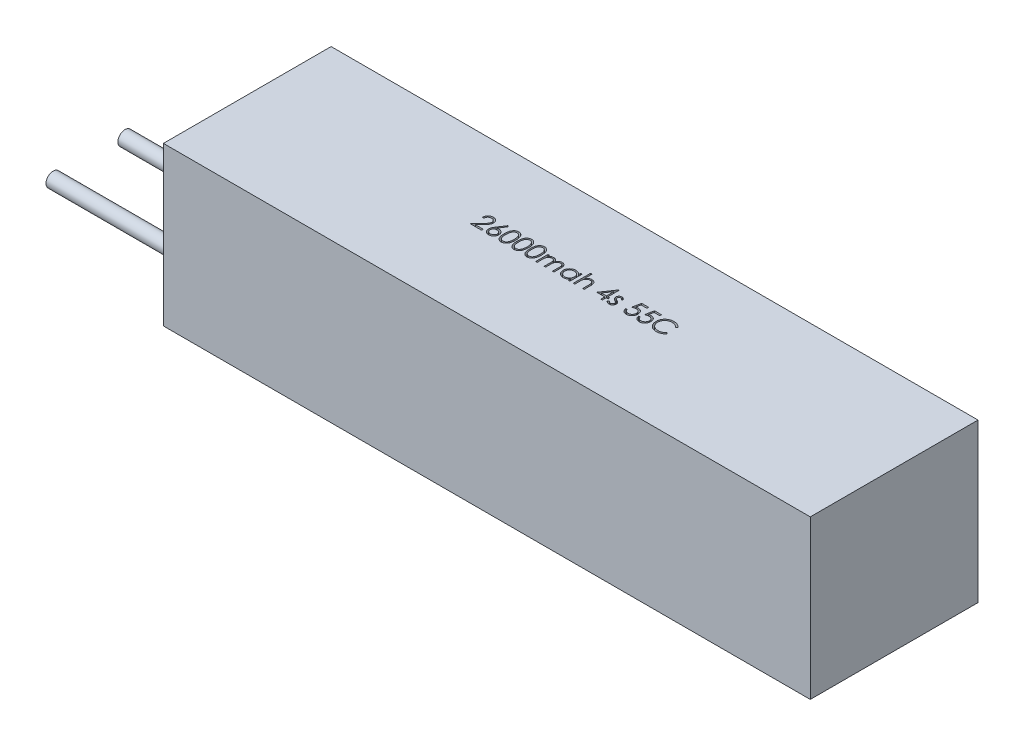
from build123d import *

# Parameters (mm, degrees)
SKETCH_1_W          = 135
SKETCH_1_H          = 35
EXTRUDE_1_DEPTH     = 33
SKETCH_2_R          = 1.5
EXTRUDE_2_DEPTH     = 33
CUT_EXTRUDE_1_DEPTH = 5


with BuildPart() as part:
    # 草图1 → 凸台-拉伸1 (new body)
    with BuildSketch(Plane(origin=(0, 0, 0), x_dir=(1, 0, 0), z_dir=(0, 1, 0))):
        Rectangle(SKETCH_1_W, SKETCH_1_H)
    extrude(amount=EXTRUDE_1_DEPTH)

    # 草图2 → 凸台-拉伸2 (add)
    with BuildSketch(Plane.ZY.offset(67.5)):
        with Locations(Location((-7.5, 5, 0), (0, 0, 180))):
            Circle(SKETCH_2_R)
        with Locations(Location((7.5, 5, 0), (0, 0, 180))):
            Circle(SKETCH_2_R)
    extrude(amount=EXTRUDE_2_DEPTH)

    # 草图3 → 切除-拉伸1 (cut)
    # profile 1 of 13: a face of its own
    with BuildSketch(Plane(origin=(0, 33, 0), x_dir=(1, 0, 0), z_dir=(0, 1, 0))):
        with BuildLine():
            Line((-20.54131021, 2.423076923), (-20.855412774, 2.423076923))
            add(Edge.make_bspline(
                [(-20.855412774, 2.423076923), (-20.853365621, 2.464747811), (-20.849345067, 2.546588325), (-20.830516778, 2.665912232), (-20.8035759, 2.779967031), (-20.765484446, 2.887836945), (-20.718178169, 2.990475752), (-20.661448141, 3.087475767), (-20.594254291, 3.178466956), (-20.518047557, 3.262605799), (-20.435278918, 3.33979337), (-20.345972978, 3.406448613), (-20.252127951, 3.462766284), (-20.154028552, 3.509847526), (-20.050567988, 3.545187372), (-19.942685131, 3.571409012), (-19.829905994, 3.587185357), (-19.753065972, 3.588881143), (-19.713986492, 3.58974359)],
                knots=[0, 0, 0, 0, 1.10065271, 2.161652631, 3.183658789, 4.190468796, 5.17591951, 6.163126047, 7.15150782, 8.156236427, 9.156009102, 10.134482811, 11.092018607, 12.041330605, 13.001268258, 13.972401359, 14.968799086, 16, 16, 16, 16], degree=3))
            add(Edge.make_bspline(
                [(-19.713986492, 3.58974359), (-19.675608418, 3.588845133), (-19.600196873, 3.587079698), (-19.490134859, 3.571918669), (-19.385357564, 3.548173078), (-19.286069798, 3.514857661), (-19.193063733, 3.470073234), (-19.105640689, 3.416275695), (-19.022759878, 3.354055864), (-18.948153094, 3.28080205), (-18.879645015, 3.202599666), (-18.82054276, 3.119111762), (-18.769929596, 3.032882477), (-18.727741916, 2.943254275), (-18.696685778, 2.849383247), (-18.673107569, 2.752636044), (-18.659780156, 2.652011233), (-18.657734732, 2.583904677), (-18.656694825, 2.549278846)],
                knots=[0, 0, 0, 0, 1.111607364, 2.184268762, 3.212621178, 4.221274766, 5.211760367, 6.196651075, 7.1921475, 8.207485113, 9.220403448, 10.201281604, 11.166441695, 12.114753415, 13.065576456, 14.026450734, 14.996634279, 16, 16, 16, 16], degree=3))
            add(Edge.make_bspline(
                [(-18.656694825, 2.549278846), (-18.658388088, 2.500531012), (-18.661744899, 2.403890798), (-18.690459276, 2.261875935), (-18.735305787, 2.124282516), (-18.789303144, 2.013545214), (-18.843775588, 1.92431172), (-18.892863096, 1.850843015), (-18.950327907, 1.771737547), (-19.017006405, 1.68726021), (-19.091519277, 1.596749304), (-19.17454144, 1.500259509), (-19.266664922, 1.398787739), (-19.331323423, 1.329482138), (-19.364827838, 1.293569712)],
                knots=[0, 0, 0, 0, 1.184426356, 2.348067706, 3.509069118, 4.696110526, 5.333549288, 6.050745305, 6.844228056, 7.710549037, 8.667450064, 9.695053472, 10.805634456, 12, 12, 12, 12], degree=3))
            Line((-19.364827838, 1.293569712), (-20.24052896, 0.358974359))
            Line((-20.24052896, 0.358974359), (-18.61182303, 0.358974359))
            Line((-18.61182303, 0.358974359), (-18.61182303, 0))
            Line((-18.61182303, 0), (-20.990028159, 0))
            Line((-20.990028159, 0), (-19.632656364, 1.448517628))
            add(Edge.make_bspline(
                [(-19.632656364, 1.448517628), (-19.599608477, 1.483015935), (-19.53613025, 1.549280121), (-19.446347673, 1.646023081), (-19.365708685, 1.735772622), (-19.293691292, 1.818359171), (-19.231857787, 1.894990738), (-19.176985555, 1.963185442), (-19.133019964, 2.025939892), (-19.085304568, 2.098680506), (-19.039090587, 2.187492823), (-18.99937823, 2.296026513), (-18.975163382, 2.407753765), (-18.972258547, 2.483255802), (-18.970797389, 2.521233974)],
                knots=[0, 0, 0, 0, 1.329631726, 2.553950428, 3.673215718, 4.687767853, 5.603093632, 6.413772471, 7.123043292, 7.734684054, 8.834405432, 9.900288307, 10.943827018, 12, 12, 12, 12], degree=3))
            add(Edge.make_bspline(
                [(-18.970797389, 2.521233974), (-18.971433132, 2.545115373), (-18.972686058, 2.592181023), (-18.983743755, 2.661186782), (-19.000454261, 2.727751596), (-19.024399519, 2.792080215), (-19.056006259, 2.853525867), (-19.094479639, 2.912163347), (-19.138869703, 2.968852313), (-19.190220972, 3.022005611), (-19.246632492, 3.070686816), (-19.306226741, 3.113810902), (-19.369276846, 3.149850012), (-19.435516968, 3.179393509), (-19.504762437, 3.202568891), (-19.577147182, 3.21862747), (-19.652471199, 3.228709954), (-19.703904694, 3.230074126), (-19.730112293, 3.230769231)],
                knots=[0, 0, 0, 0, 0.991446411, 1.95395049, 2.89581595, 3.838931463, 4.798493298, 5.75982156, 6.748411868, 7.785213223, 8.824556874, 9.840280684, 10.836137867, 11.835679398, 12.848801643, 13.863922112, 14.911575587, 16, 16, 16, 16], degree=3))
            add(Edge.make_bspline(
                [(-19.730112293, 3.230769231), (-19.757483126, 3.230054199), (-19.811234922, 3.228649993), (-19.890153955, 3.218827329), (-19.965439733, 3.201881489), (-20.037281636, 3.178704814), (-20.105801221, 3.149246266), (-20.170665265, 3.112554521), (-20.231728155, 3.068771028), (-20.289104678, 3.019130471), (-20.341968657, 2.96386287), (-20.388415533, 2.902252907), (-20.428999547, 2.835425492), (-20.464408781, 2.763560941), (-20.493164471, 2.686007161), (-20.515137621, 2.603039456), (-20.532524468, 2.515018075), (-20.538332988, 2.45423299), (-20.54131021, 2.423076923)],
                knots=[0, 0, 0, 0, 1.031018746, 2.02475058, 2.990194455, 3.934040569, 4.864654155, 5.795059489, 6.735614925, 7.690564532, 8.649604399, 9.611025574, 10.590972636, 11.591080095, 12.624614302, 13.701020113, 14.821632451, 16, 16, 16, 16], degree=3))
        make_face()
    # profile 2 of 13: a face of its own
    with BuildSketch(Plane(origin=(0, 33, 0), x_dir=(1, 0, 0), z_dir=(0, 1, 0))):
        with BuildLine():
            Line((-16.682335851, 3.58974359), (-16.440448832, 3.399739583))
            Line((-16.440448832, 3.399739583), (-17.365228479, 1.985576923))
            add(Edge.make_bspline(
                [(-17.365228479, 1.985576923), (-17.303658202, 1.995390784), (-17.183558415, 2.014533829), (-17.061992517, 2.017691774), (-17.002748511, 2.019230769)],
                knots=[0, 0, 0, 0, 1.025318673, 2, 2, 2, 2], degree=3))
            add(Edge.make_bspline(
                [(-17.002748511, 2.019230769), (-16.967176015, 2.018274658), (-16.897152614, 2.01639258), (-16.794345812, 2.001908729), (-16.695556876, 1.979083617), (-16.601195264, 1.945811362), (-16.510922282, 1.903309007), (-16.424219886, 1.852370137), (-16.342717876, 1.790364457), (-16.265366697, 1.721099501), (-16.195139599, 1.644382516), (-16.132963544, 1.56298118), (-16.080736752, 1.476980299), (-16.03836283, 1.386423433), (-16.005457952, 1.291450173), (-15.981470307, 1.192182034), (-15.967290714, 1.088550562), (-15.965365223, 1.018072387), (-15.964387133, 0.982271635)],
                knots=[0, 0, 0, 0, 1.04369286, 2.054478336, 3.041073146, 4.015093852, 4.984733326, 5.965804835, 6.960378782, 7.985147595, 9.009457201, 10.008161701, 10.986880575, 11.956520048, 12.937015923, 13.931873656, 14.949455224, 16, 16, 16, 16], degree=3))
            add(Edge.make_bspline(
                [(-15.964387133, 0.982271635), (-15.965810238, 0.933291931), (-15.968610571, 0.836911465), (-15.996514367, 0.696534758), (-16.039874012, 0.562802243), (-16.101851541, 0.437849071), (-16.178833924, 0.321846502), (-16.272711516, 0.219061036), (-16.380155005, 0.127390999), (-16.501641803, 0.05073438), (-16.632384767, -0.011868671), (-16.769736764, -0.056833913), (-16.912363911, -0.084517383), (-17.009168519, -0.087987985), (-17.058137133, -0.08974359)],
                knots=[0, 0, 0, 0, 1.031375318, 2.029502543, 3.004789286, 3.987476834, 4.960371455, 5.9300674, 6.912260825, 7.929083631, 8.949397511, 9.960523116, 10.96833055, 12, 12, 12, 12], degree=3))
            add(Edge.make_bspline(
                [(-17.058137133, -0.08974359), (-17.105233834, -0.088215384), (-17.198524152, -0.085188276), (-17.335756946, -0.058222338), (-17.467619963, -0.014515235), (-17.593189344, 0.045699043), (-17.709509957, 0.121756926), (-17.813575593, 0.213319205), (-17.904867368, 0.31842867), (-17.980841989, 0.437069018), (-18.041100721, 0.564558975), (-18.086290646, 0.697496132), (-18.112686889, 0.835396113), (-18.116375446, 0.928877252), (-18.118233287, 0.975961538)],
                knots=[0, 0, 0, 0, 1.012016664, 2.004627821, 2.994792927, 3.992885782, 4.990978636, 5.973936114, 6.964471063, 7.975201453, 8.993600317, 9.990122807, 10.98767138, 12, 12, 12, 12], degree=3))
            add(Edge.make_bspline(
                [(-18.118233287, 0.975961538), (-18.117051842, 1.012006122), (-18.114639557, 1.085602274), (-18.097796166, 1.197066302), (-18.070731372, 1.311117383), (-18.040421125, 1.407871577), (-18.008395515, 1.487133099), (-17.981742976, 1.55103659), (-17.94856898, 1.616797663), (-17.913195598, 1.686671299), (-17.87243873, 1.758856731), (-17.82812308, 1.834560401), (-17.779023429, 1.912578329), (-17.744603267, 1.965522524), (-17.727007325, 1.992588141)],
                knots=[0, 0, 0, 0, 1.173818275, 2.396712641, 3.66331629, 4.989737886, 5.693666774, 6.447286557, 7.243889047, 8.091586357, 8.998013824, 9.943181721, 10.948533338, 12, 12, 12, 12], degree=3))
            Line((-17.727007325, 1.992588141), (-16.682335851, 3.58974359))
        make_face()
        with BuildLine():
            add(Edge.make_bspline(
                [(-17.06865396, 1.66025641), (-17.095316205, 1.659478367), (-17.147395314, 1.657958621), (-17.223802729, 1.649133369), (-17.29611598, 1.632514304), (-17.365293114, 1.611347972), (-17.430040817, 1.582244912), (-17.490829657, 1.546893113), (-17.547894709, 1.505271935), (-17.60063826, 1.457971024), (-17.648457924, 1.406182991), (-17.689639054, 1.350713469), (-17.725161455, 1.292899266), (-17.754043273, 1.232257323), (-17.776533349, 1.168810824), (-17.7928016, 1.102851574), (-17.801855351, 1.033937268), (-17.803361583, 0.987204766), (-17.804130723, 0.963341346)],
                knots=[0, 0, 0, 0, 1.129588631, 2.206414736, 3.251139165, 4.268635594, 5.265702196, 6.250456724, 7.242448911, 8.251968645, 9.246821453, 10.222880186, 11.173611482, 12.116736599, 13.062300278, 14.020270554, 14.989073742, 16, 16, 16, 16], degree=3))
            add(Edge.make_bspline(
                [(-17.804130723, 0.963341346), (-17.803504361, 0.939691366), (-17.80227616, 0.893317277), (-17.79112384, 0.824978097), (-17.774088757, 0.759213189), (-17.748748362, 0.69636159), (-17.718521473, 0.635465272), (-17.678616149, 0.578729986), (-17.634399363, 0.522709916), (-17.58154543, 0.471708445), (-17.524822067, 0.424251821), (-17.464220864, 0.382771567), (-17.401060905, 0.347285394), (-17.334489482, 0.319474296), (-17.265451099, 0.296650009), (-17.193370544, 0.28058853), (-17.118197689, 0.271508004), (-17.067275751, 0.26999981), (-17.04131021, 0.269230769)],
                knots=[0, 0, 0, 0, 0.989467248, 1.94019797, 2.891935182, 3.827694429, 4.772920941, 5.730924762, 6.725747692, 7.756678648, 8.79901574, 9.819492441, 10.826891316, 11.826466727, 12.835195252, 13.867842842, 14.912794438, 16, 16, 16, 16], degree=3))
            add(Edge.make_bspline(
                [(-17.04131021, 0.269230769), (-17.015344711, 0.269999871), (-16.964422857, 0.271508182), (-16.889249397, 0.280587851), (-16.817171078, 0.296652499), (-16.748124569, 0.31946527), (-16.681583138, 0.347318879), (-16.618478417, 0.382550799), (-16.558450323, 0.424506917), (-16.501689724, 0.471627345), (-16.449055785, 0.523000197), (-16.403778506, 0.578229919), (-16.365095273, 0.635923815), (-16.333661086, 0.696121704), (-16.308599795, 0.759251192), (-16.291478328, 0.824967916), (-16.280349039, 0.893319942), (-16.279117672, 0.939692266), (-16.278489697, 0.963341346)],
                knots=[0, 0, 0, 0, 1.087397944, 2.132534446, 3.165364764, 4.174271784, 5.174024072, 6.181601208, 7.194203697, 8.236725232, 9.267838612, 10.269026844, 11.221737037, 12.171628256, 13.107553087, 14.05945871, 15.010357665, 16, 16, 16, 16], degree=3))
            add(Edge.make_bspline(
                [(-16.278489697, 0.963341346), (-16.27903999, 0.987235897), (-16.280120036, 1.03413313), (-16.292335985, 1.102820748), (-16.309278359, 1.169145954), (-16.334861389, 1.232691903), (-16.368097934, 1.29320783), (-16.408581341, 1.350999431), (-16.455413911, 1.406509779), (-16.509511451, 1.458072587), (-16.568401685, 1.505219665), (-16.63101727, 1.546839221), (-16.696525244, 1.581964198), (-16.764859187, 1.6112713), (-16.836802069, 1.632420774), (-16.911192408, 1.649074017), (-16.988981651, 1.657936035), (-17.041758259, 1.6594731), (-17.06865396, 1.66025641)],
                knots=[0, 0, 0, 0, 0.978206639, 1.919901502, 2.851605144, 3.780102724, 4.718870031, 5.675451981, 6.667674623, 7.690630536, 8.733308323, 9.756129687, 10.767539656, 11.776269907, 12.797430371, 13.836405707, 14.897401972, 16, 16, 16, 16], degree=3))
        make_face(mode=Mode.SUBTRACT)
    # profile 3 of 13: a face of its own
    with BuildSketch(Plane(origin=(0, 33, 0), x_dir=(1, 0, 0), z_dir=(0, 1, 0))):
        with BuildLine():
            add(Edge.make_bspline(
                [(-15.605412774, 1.748597756), (-15.605084756, 1.804695144), (-15.604447576, 1.913665128), (-15.597359155, 2.07244977), (-15.585583813, 2.221410059), (-15.56944644, 2.360553125), (-15.549808459, 2.48991489), (-15.523592973, 2.609149647), (-15.49378017, 2.718809254), (-15.459227724, 2.819251302), (-15.420239935, 2.911829005), (-15.377805675, 2.998254207), (-15.33024088, 3.078396139), (-15.280263967, 3.153533929), (-15.225851896, 3.222437624), (-15.168553105, 3.286080287), (-15.106131229, 3.342991037), (-15.040708221, 3.394837339), (-14.971691756, 3.440286811), (-14.90104909, 3.48031955), (-14.828293984, 3.514519417), (-14.753227801, 3.541409853), (-14.676525244, 3.5636207), (-14.597918177, 3.578809647), (-14.517276813, 3.588366556), (-14.462845378, 3.589280224), (-14.435240498, 3.58974359)],
                knots=[0, 0, 0, 0, 1.646270934, 3.197905019, 4.663502075, 6.030701355, 7.308322542, 8.50163776, 9.611534131, 10.641858119, 11.616356847, 12.558055219, 13.465016945, 14.349605745, 15.204443733, 16.039544428, 16.859896111, 17.680448484, 18.487036065, 19.28249412, 20.06191084, 20.843045899, 21.620316918, 22.403196591, 23.190181807, 24, 24, 24, 24], degree=3))
            add(Edge.make_bspline(
                [(-14.435240498, 3.58974359), (-14.40740502, 3.589255775), (-14.352049011, 3.588285664), (-14.270208636, 3.578961721), (-14.190258954, 3.563490598), (-14.112540815, 3.541569623), (-14.036415829, 3.514373947), (-13.962479421, 3.48028683), (-13.89027234, 3.440607962), (-13.820942052, 3.393984085), (-13.753727437, 3.342001809), (-13.690279474, 3.28323914), (-13.630592388, 3.218289421), (-13.573917082, 3.147847557), (-13.521861485, 3.070562472), (-13.472288053, 2.987778362), (-13.427916017, 2.898047497), (-13.385181342, 2.80286703), (-13.348294355, 2.699603371), (-13.31502811, 2.58883861), (-13.288149141, 2.469264423), (-13.265759869, 2.341508178), (-13.248414973, 2.205100695), (-13.235782331, 2.060334379), (-13.229109246, 1.907113989), (-13.227852545, 1.80235614), (-13.227207646, 1.748597756)],
                knots=[0, 0, 0, 0, 0.810914788, 1.612654377, 2.396697861, 3.181598691, 3.963628158, 4.749916497, 5.551656086, 6.361998678, 7.18212741, 8.025565596, 8.878627764, 9.750805457, 10.657531673, 11.591944965, 12.560506719, 13.57287815, 14.630710178, 15.753379473, 16.941251878, 18.199788006, 19.531962791, 20.947069417, 22.433333509, 24, 24, 24, 24], degree=3))
            add(Edge.make_bspline(
                [(-13.227207646, 1.748597756), (-13.22785923, 1.695073848), (-13.229128816, 1.590784697), (-13.235707523, 1.438253721), (-13.248666154, 1.294255678), (-13.264876142, 1.158445216), (-13.287327105, 1.031387597), (-13.314932272, 0.912643148), (-13.345582595, 0.801699077), (-13.383417389, 0.699464265), (-13.424828099, 0.604512542), (-13.469883295, 0.515845394), (-13.518153121, 0.432679101), (-13.570741866, 0.355679354), (-13.626795279, 0.284300697), (-13.687513068, 0.219803074), (-13.751183653, 0.160632402), (-13.818596069, 0.107980775), (-13.88900762, 0.06189597), (-13.960966697, 0.02068212), (-14.035750081, -0.012550575), (-14.111663033, -0.041085616), (-14.1897914, -0.062886068), (-14.27003779, -0.077959923), (-14.351994026, -0.088531772), (-14.407395591, -0.089338252), (-14.435240498, -0.08974359)],
                knots=[0, 0, 0, 0, 1.561518951, 3.042555995, 4.452378317, 5.7783523, 7.031515105, 8.214008947, 9.334062868, 10.386615937, 11.391082383, 12.354592575, 13.286541444, 14.194233754, 15.072674879, 15.931287219, 16.775624067, 17.606195743, 18.42308326, 19.229000347, 20.022332153, 20.807536673, 21.593273796, 22.3848459, 23.188221202, 24, 24, 24, 24], degree=3))
            add(Edge.make_bspline(
                [(-14.435240498, -0.08974359), (-14.462844612, -0.089277234), (-14.517274537, -0.088357672), (-14.597926963, -0.078843941), (-14.676209406, -0.063548438), (-14.75250816, -0.042131834), (-14.827214675, -0.015916997), (-14.899310962, 0.018236686), (-14.969598645, 0.057570755), (-15.037890201, 0.102366177), (-15.102902362, 0.15368786), (-15.165000968, 0.210452149), (-15.222625987, 0.27407556), (-15.276260083, 0.343553483), (-15.327234171, 0.418246725), (-15.374123544, 0.499175098), (-15.417494398, 0.586017709), (-15.457137889, 0.67933562), (-15.492286552, 0.780490547), (-15.52333426, 0.890639726), (-15.547848418, 1.010755362), (-15.568831373, 1.139872729), (-15.585755756, 1.278546659), (-15.597310082, 1.426852438), (-15.604451397, 1.584697647), (-15.605086467, 1.692967421), (-15.605412774, 1.748597756)],
                knots=[0, 0, 0, 0, 0.810891512, 1.598919785, 2.382837074, 3.152667961, 3.926044502, 4.706494248, 5.493654104, 6.291793342, 7.103789334, 7.925228297, 8.761435821, 9.622817696, 10.50288917, 11.416980706, 12.369136599, 13.353924996, 14.394355917, 15.514179734, 16.714354668, 17.994756427, 19.357759367, 20.818452758, 22.365282078, 24, 24, 24, 24], degree=3))
        make_face()
        with BuildLine():
            add(Edge.make_bspline(
                [(-15.29131021, 1.75), (-15.291190763, 1.703251301), (-15.290958939, 1.612521256), (-15.284902739, 1.480677995), (-15.276652507, 1.357707667), (-15.26601121, 1.24345413), (-15.250208261, 1.138304118), (-15.232501473, 1.041534435), (-15.210953384, 0.953657197), (-15.185458366, 0.874069387), (-15.156419269, 0.801420318), (-15.124713405, 0.733819103), (-15.090652682, 0.670467167), (-15.052533532, 0.611933558), (-15.011018469, 0.558027394), (-14.96704521, 0.507794562), (-14.918972625, 0.462997581), (-14.852468883, 0.409270726), (-14.764672408, 0.353751592), (-14.654051953, 0.305405502), (-14.540383502, 0.275023046), (-14.463232252, 0.27115929), (-14.424723671, 0.269230769)],
                knots=[0, 0, 0, 0, 1.459021318, 2.831673884, 4.118529203, 5.306027144, 6.411944654, 7.436330062, 8.375795394, 9.233974572, 10.042671642, 10.816086306, 11.563610507, 12.285937304, 12.993564865, 13.685989202, 14.367179055, 15.041617293, 16.353048772, 17.594441528, 18.799311195, 20, 20, 20, 20], degree=3))
            add(Edge.make_bspline(
                [(-14.424723671, 0.269230769), (-14.385966, 0.27082855), (-14.308530677, 0.274020813), (-14.195396881, 0.30481955), (-14.085566611, 0.35128909), (-13.999494671, 0.406236595), (-13.934012128, 0.458564925), (-13.887095137, 0.503179573), (-13.844033089, 0.55313544), (-13.803191014, 0.607034736), (-13.765731938, 0.66590722), (-13.731668801, 0.729469796), (-13.700585453, 0.797898973), (-13.682876407, 0.845668713), (-13.673822229, 0.870092147)],
                knots=[0, 0, 0, 0, 1.353760809, 2.704726607, 4.075137775, 5.516104923, 6.260822281, 7.007110065, 7.778089737, 8.566572457, 9.372053459, 10.217411131, 11.088608312, 12, 12, 12, 12], degree=3))
            add(Edge.make_bspline(
                [(-13.673822229, 0.870092147), (-13.663270461, 0.901321887), (-13.641845847, 0.964731651), (-13.614234073, 1.063095303), (-13.592488674, 1.166298067), (-13.572925308, 1.273723184), (-13.559572252, 1.386162885), (-13.548824439, 1.503269269), (-13.542493752, 1.625130631), (-13.541709001, 1.707925622), (-13.54131021, 1.75)],
                knots=[0, 0, 0, 0, 0.884706709, 1.796334032, 2.740027952, 3.714592787, 4.726048262, 5.777819803, 6.87074269, 8, 8, 8, 8], degree=3))
            add(Edge.make_bspline(
                [(-13.54131021, 1.75), (-13.541860399, 1.792067573), (-13.542936687, 1.874360737), (-13.547050675, 1.994878918), (-13.557674249, 2.109346679), (-13.569473368, 2.218257152), (-13.586870589, 2.321007454), (-13.605628396, 2.418457759), (-13.630829608, 2.509400784), (-13.657749383, 2.595260366), (-13.688559779, 2.675061021), (-13.722475513, 2.749174807), (-13.758697272, 2.817959532), (-13.798039512, 2.881226473), (-13.840035195, 2.939259016), (-13.885792744, 2.990893611), (-13.933497117, 3.037730579), (-14.000314303, 3.091193148), (-14.087788593, 3.145704843), (-14.19663424, 3.195870603), (-14.309904884, 3.224678896), (-14.386478339, 3.228740583), (-14.424723671, 3.230769231)],
                knots=[0, 0, 0, 0, 1.31362396, 2.569729283, 3.763502607, 4.902122613, 5.988968491, 7.01645872, 7.998833611, 8.933434873, 9.825090667, 10.667526885, 11.477055099, 12.250526234, 12.991942729, 13.710640831, 14.402115721, 15.076753259, 16.378508321, 17.609869233, 18.806226677, 20, 20, 20, 20], degree=3))
            add(Edge.make_bspline(
                [(-14.424723671, 3.230769231), (-14.463434263, 3.228737784), (-14.540925969, 3.22467119), (-14.655373924, 3.195977936), (-14.765078275, 3.14596497), (-14.85232125, 3.091012598), (-14.919185037, 3.038674287), (-14.96626773, 2.993287833), (-15.010413902, 2.943641578), (-15.051081602, 2.889239663), (-15.089170886, 2.830774296), (-15.124151898, 2.767785531), (-15.155669228, 2.699954167), (-15.184753764, 2.627337732), (-15.210326552, 2.547756787), (-15.231420515, 2.459987794), (-15.250907568, 2.363525902), (-15.264702837, 2.257806394), (-15.276966593, 2.14352424), (-15.284847941, 2.020246922), (-15.290979198, 1.888182542), (-15.291197663, 1.796983383), (-15.29131021, 1.75)],
                knots=[0, 0, 0, 0, 1.207732386, 2.417664972, 3.655092373, 4.956220595, 5.625982001, 6.301752483, 6.994047911, 7.697131622, 8.419323945, 9.170223765, 9.943494443, 10.752040957, 11.610060368, 12.549350801, 13.567764191, 14.679664412, 15.874934091, 17.154273443, 18.533957287, 20, 20, 20, 20], degree=3))
        make_face(mode=Mode.SUBTRACT)
    # profile 4 of 13: a face of its own
    with BuildSketch(Plane(origin=(0, 33, 0), x_dir=(1, 0, 0), z_dir=(0, 1, 0))):
        with BuildLine():
            add(Edge.make_bspline(
                [(-12.913105082, 1.748597756), (-12.912777064, 1.804695144), (-12.912139884, 1.913665128), (-12.905051463, 2.07244977), (-12.89327612, 2.221410059), (-12.877138747, 2.360553125), (-12.857500767, 2.48991489), (-12.831285281, 2.609149647), (-12.801472478, 2.718809254), (-12.766920032, 2.819251302), (-12.727932243, 2.911829005), (-12.685497982, 2.998254207), (-12.637933188, 3.078396139), (-12.587956275, 3.153533929), (-12.533544203, 3.222437624), (-12.476245413, 3.286080287), (-12.413823537, 3.342991037), (-12.348400528, 3.394837339), (-12.279384064, 3.440286811), (-12.208741398, 3.48031955), (-12.135986292, 3.514519417), (-12.060920109, 3.541409853), (-11.984217551, 3.5636207), (-11.905610485, 3.578809647), (-11.824969121, 3.588366556), (-11.770537686, 3.589280224), (-11.742932806, 3.58974359)],
                knots=[0, 0, 0, 0, 1.646270934, 3.197905019, 4.663502075, 6.030701355, 7.308322542, 8.50163776, 9.611534131, 10.641858119, 11.616356847, 12.558055219, 13.465016945, 14.349605745, 15.204443733, 16.039544428, 16.859896111, 17.680448484, 18.487036065, 19.28249412, 20.06191084, 20.843045899, 21.620316918, 22.403196591, 23.190181807, 24, 24, 24, 24], degree=3))
            add(Edge.make_bspline(
                [(-11.742932806, 3.58974359), (-11.715097328, 3.589255775), (-11.659741319, 3.588285664), (-11.577900943, 3.578961721), (-11.497951262, 3.563490598), (-11.420233123, 3.541569623), (-11.344108137, 3.514373947), (-11.270171729, 3.48028683), (-11.197964647, 3.440607962), (-11.12863436, 3.393984085), (-11.061419744, 3.342001809), (-10.997971781, 3.28323914), (-10.938284695, 3.218289421), (-10.88160939, 3.147847557), (-10.829553793, 3.070562472), (-10.779980361, 2.987778362), (-10.735608325, 2.898047497), (-10.69287365, 2.80286703), (-10.655986663, 2.699603371), (-10.622720418, 2.58883861), (-10.595841449, 2.469264423), (-10.573452177, 2.341508178), (-10.556107281, 2.205100695), (-10.543474639, 2.060334379), (-10.536801554, 1.907113989), (-10.535544852, 1.80235614), (-10.534899953, 1.748597756)],
                knots=[0, 0, 0, 0, 0.810914788, 1.612654377, 2.396697861, 3.181598691, 3.963628158, 4.749916497, 5.551656086, 6.361998678, 7.18212741, 8.025565596, 8.878627764, 9.750805457, 10.657531673, 11.591944965, 12.560506719, 13.57287815, 14.630710178, 15.753379473, 16.941251878, 18.199788006, 19.531962791, 20.947069417, 22.433333509, 24, 24, 24, 24], degree=3))
            add(Edge.make_bspline(
                [(-10.534899953, 1.748597756), (-10.535551538, 1.695073848), (-10.536821124, 1.590784697), (-10.543399831, 1.438253721), (-10.556358462, 1.294255678), (-10.57256845, 1.158445216), (-10.595019413, 1.031387597), (-10.622624579, 0.912643148), (-10.653274902, 0.801699077), (-10.691109696, 0.699464265), (-10.732520407, 0.604512542), (-10.777575603, 0.515845394), (-10.825845429, 0.432679101), (-10.878434174, 0.355679354), (-10.934487587, 0.284300697), (-10.995205376, 0.219803074), (-11.058875961, 0.160632402), (-11.126288377, 0.107980775), (-11.196699928, 0.06189597), (-11.268659005, 0.02068212), (-11.343442388, -0.012550575), (-11.419355341, -0.041085616), (-11.497483707, -0.062886068), (-11.577730098, -0.077959923), (-11.659686334, -0.088531772), (-11.715087899, -0.089338252), (-11.742932806, -0.08974359)],
                knots=[0, 0, 0, 0, 1.561518951, 3.042555995, 4.452378317, 5.7783523, 7.031515105, 8.214008947, 9.334062868, 10.386615937, 11.391082383, 12.354592575, 13.286541444, 14.194233754, 15.072674879, 15.931287219, 16.775624067, 17.606195743, 18.42308326, 19.229000347, 20.022332153, 20.807536673, 21.593273796, 22.3848459, 23.188221202, 24, 24, 24, 24], degree=3))
            add(Edge.make_bspline(
                [(-11.742932806, -0.08974359), (-11.77053692, -0.089277234), (-11.824966845, -0.088357672), (-11.90561927, -0.078843941), (-11.983901714, -0.063548438), (-12.060200468, -0.042131834), (-12.134906983, -0.015916997), (-12.207003269, 0.018236686), (-12.277290953, 0.057570755), (-12.345582509, 0.102366177), (-12.41059467, 0.15368786), (-12.472693275, 0.210452149), (-12.530318295, 0.27407556), (-12.58395239, 0.343553483), (-12.634926478, 0.418246725), (-12.681815852, 0.499175098), (-12.725186706, 0.586017709), (-12.764830196, 0.67933562), (-12.79997886, 0.780490547), (-12.831026568, 0.890639726), (-12.855540726, 1.010755362), (-12.876523681, 1.139872729), (-12.893448064, 1.278546659), (-12.905002389, 1.426852438), (-12.912143704, 1.584697647), (-12.912778775, 1.692967421), (-12.913105082, 1.748597756)],
                knots=[0, 0, 0, 0, 0.810891512, 1.598919785, 2.382837074, 3.152667961, 3.926044502, 4.706494248, 5.493654104, 6.291793342, 7.103789334, 7.925228297, 8.761435821, 9.622817696, 10.50288917, 11.416980706, 12.369136599, 13.353924996, 14.394355917, 15.514179734, 16.714354668, 17.994756427, 19.357759367, 20.818452758, 22.365282078, 24, 24, 24, 24], degree=3))
        make_face()
        with BuildLine():
            add(Edge.make_bspline(
                [(-12.599002518, 1.75), (-12.59888307, 1.703251301), (-12.598651247, 1.612521256), (-12.592595047, 1.480677995), (-12.584344815, 1.357707667), (-12.573703517, 1.24345413), (-12.557900569, 1.138304118), (-12.540193781, 1.041534435), (-12.518645691, 0.953657197), (-12.493150674, 0.874069387), (-12.464111577, 0.801420318), (-12.432405713, 0.733819103), (-12.39834499, 0.670467167), (-12.36022584, 0.611933558), (-12.318710776, 0.558027394), (-12.274737517, 0.507794562), (-12.226664933, 0.462997581), (-12.16016119, 0.409270726), (-12.072364716, 0.353751592), (-11.961744261, 0.305405502), (-11.84807581, 0.275023046), (-11.77092456, 0.27115929), (-11.732415979, 0.269230769)],
                knots=[0, 0, 0, 0, 1.459021318, 2.831673884, 4.118529203, 5.306027144, 6.411944654, 7.436330062, 8.375795394, 9.233974572, 10.042671642, 10.816086306, 11.563610507, 12.285937304, 12.993564865, 13.685989202, 14.367179055, 15.041617293, 16.353048772, 17.594441528, 18.799311195, 20, 20, 20, 20], degree=3))
            add(Edge.make_bspline(
                [(-11.732415979, 0.269230769), (-11.693658307, 0.27082855), (-11.616222984, 0.274020813), (-11.503089189, 0.30481955), (-11.393258919, 0.35128909), (-11.307186979, 0.406236595), (-11.241704435, 0.458564925), (-11.194787445, 0.503179573), (-11.151725397, 0.55313544), (-11.110883322, 0.607034736), (-11.073424246, 0.66590722), (-11.039361108, 0.729469796), (-11.008277761, 0.797898973), (-10.990568715, 0.845668713), (-10.981514537, 0.870092147)],
                knots=[0, 0, 0, 0, 1.353760809, 2.704726607, 4.075137775, 5.516104923, 6.260822281, 7.007110065, 7.778089737, 8.566572457, 9.372053459, 10.217411131, 11.088608312, 12, 12, 12, 12], degree=3))
            add(Edge.make_bspline(
                [(-10.981514537, 0.870092147), (-10.970962769, 0.901321887), (-10.949538155, 0.964731651), (-10.921926381, 1.063095303), (-10.900180982, 1.166298067), (-10.880617616, 1.273723184), (-10.86726456, 1.386162885), (-10.856516747, 1.503269269), (-10.85018606, 1.625130631), (-10.849401309, 1.707925622), (-10.849002518, 1.75)],
                knots=[0, 0, 0, 0, 0.884706709, 1.796334032, 2.740027952, 3.714592787, 4.726048262, 5.777819803, 6.87074269, 8, 8, 8, 8], degree=3))
            add(Edge.make_bspline(
                [(-10.849002518, 1.75), (-10.849552707, 1.792067573), (-10.850628995, 1.874360737), (-10.854742982, 1.994878918), (-10.865366557, 2.109346679), (-10.877165676, 2.218257152), (-10.894562897, 2.321007454), (-10.913320704, 2.418457759), (-10.938521916, 2.509400784), (-10.965441691, 2.595260366), (-10.996252086, 2.675061021), (-11.030167821, 2.749174807), (-11.066389579, 2.817959532), (-11.10573182, 2.881226473), (-11.147727503, 2.939259016), (-11.193485052, 2.990893611), (-11.241189425, 3.037730579), (-11.308006611, 3.091193148), (-11.395480901, 3.145704843), (-11.504326548, 3.195870603), (-11.617597192, 3.224678896), (-11.694170646, 3.228740583), (-11.732415979, 3.230769231)],
                knots=[0, 0, 0, 0, 1.31362396, 2.569729283, 3.763502607, 4.902122613, 5.988968491, 7.01645872, 7.998833611, 8.933434873, 9.825090667, 10.667526885, 11.477055099, 12.250526234, 12.991942729, 13.710640831, 14.402115721, 15.076753259, 16.378508321, 17.609869233, 18.806226677, 20, 20, 20, 20], degree=3))
            add(Edge.make_bspline(
                [(-11.732415979, 3.230769231), (-11.771126571, 3.228737784), (-11.848618277, 3.22467119), (-11.963066232, 3.195977936), (-12.072770583, 3.14596497), (-12.160013558, 3.091012598), (-12.226877344, 3.038674287), (-12.273960038, 2.993287833), (-12.31810621, 2.943641578), (-12.35877391, 2.889239663), (-12.396863193, 2.830774296), (-12.431844206, 2.767785531), (-12.463361536, 2.699954167), (-12.492446072, 2.627337732), (-12.51801886, 2.547756787), (-12.539112823, 2.459987794), (-12.558599876, 2.363525902), (-12.572395145, 2.257806394), (-12.584658901, 2.14352424), (-12.592540249, 2.020246922), (-12.598671506, 1.888182542), (-12.598889971, 1.796983383), (-12.599002518, 1.75)],
                knots=[0, 0, 0, 0, 1.207732386, 2.417664972, 3.655092373, 4.956220595, 5.625982001, 6.301752483, 6.994047911, 7.697131622, 8.419323945, 9.170223765, 9.943494443, 10.752040957, 11.610060368, 12.549350801, 13.567764191, 14.679664412, 15.874934091, 17.154273443, 18.533957287, 20, 20, 20, 20], degree=3))
        make_face(mode=Mode.SUBTRACT)
    # profile 5 of 13: a face of its own
    with BuildSketch(Plane(origin=(0, 33, 0), x_dir=(1, 0, 0), z_dir=(0, 1, 0))):
        with BuildLine():
            add(Edge.make_bspline(
                [(-10.220797389, 1.748597756), (-10.220469371, 1.804695144), (-10.219832191, 1.913665128), (-10.21274377, 2.07244977), (-10.200968428, 2.221410059), (-10.184831055, 2.360553125), (-10.165193075, 2.48991489), (-10.138977588, 2.609149647), (-10.109164786, 2.718809254), (-10.07461234, 2.819251302), (-10.035624551, 2.911829005), (-9.99319029, 2.998254207), (-9.945625496, 3.078396139), (-9.895648583, 3.153533929), (-9.841236511, 3.222437624), (-9.783937721, 3.286080287), (-9.721515844, 3.342991037), (-9.656092836, 3.394837339), (-9.587076372, 3.440286811), (-9.516433706, 3.48031955), (-9.4436786, 3.514519417), (-9.368612417, 3.541409853), (-9.291909859, 3.5636207), (-9.213302792, 3.578809647), (-9.132661428, 3.588366556), (-9.078229994, 3.589280224), (-9.050625114, 3.58974359)],
                knots=[0, 0, 0, 0, 1.646270934, 3.197905019, 4.663502075, 6.030701355, 7.308322542, 8.50163776, 9.611534131, 10.641858119, 11.616356847, 12.558055219, 13.465016945, 14.349605745, 15.204443733, 16.039544428, 16.859896111, 17.680448484, 18.487036065, 19.28249412, 20.06191084, 20.843045899, 21.620316918, 22.403196591, 23.190181807, 24, 24, 24, 24], degree=3))
            add(Edge.make_bspline(
                [(-9.050625114, 3.58974359), (-9.022789635, 3.589255775), (-8.967433626, 3.588285664), (-8.885593251, 3.578961721), (-8.805643569, 3.563490598), (-8.727925431, 3.541569623), (-8.651800444, 3.514373947), (-8.577864037, 3.48028683), (-8.505656955, 3.440607962), (-8.436326667, 3.393984085), (-8.369112052, 3.342001809), (-8.305664089, 3.28323914), (-8.245977003, 3.218289421), (-8.189301698, 3.147847557), (-8.137246101, 3.070562472), (-8.087672668, 2.987778362), (-8.043300632, 2.898047497), (-8.000565957, 2.80286703), (-7.963678971, 2.699603371), (-7.930412725, 2.58883861), (-7.903533757, 2.469264423), (-7.881144484, 2.341508178), (-7.863799588, 2.205100695), (-7.851166946, 2.060334379), (-7.844493861, 1.907113989), (-7.84323716, 1.80235614), (-7.842592261, 1.748597756)],
                knots=[0, 0, 0, 0, 0.810914788, 1.612654377, 2.396697861, 3.181598691, 3.963628158, 4.749916497, 5.551656086, 6.361998678, 7.18212741, 8.025565596, 8.878627764, 9.750805457, 10.657531673, 11.591944965, 12.560506719, 13.57287815, 14.630710178, 15.753379473, 16.941251878, 18.199788006, 19.531962791, 20.947069417, 22.433333509, 24, 24, 24, 24], degree=3))
            add(Edge.make_bspline(
                [(-7.842592261, 1.748597756), (-7.843243846, 1.695073848), (-7.844513432, 1.590784697), (-7.851092138, 1.438253721), (-7.86405077, 1.294255678), (-7.880260758, 1.158445216), (-7.902711721, 1.031387597), (-7.930316887, 0.912643148), (-7.96096721, 0.801699077), (-7.998802004, 0.699464265), (-8.040212714, 0.604512542), (-8.085267911, 0.515845394), (-8.133537737, 0.432679101), (-8.186126482, 0.355679354), (-8.242179895, 0.284300697), (-8.302897684, 0.219803074), (-8.366568269, 0.160632402), (-8.433980685, 0.107980775), (-8.504392236, 0.06189597), (-8.576351313, 0.02068212), (-8.651134696, -0.012550575), (-8.727047649, -0.041085616), (-8.805176015, -0.062886068), (-8.885422406, -0.077959923), (-8.967378642, -0.088531772), (-9.022780207, -0.089338252), (-9.050625114, -0.08974359)],
                knots=[0, 0, 0, 0, 1.561518951, 3.042555995, 4.452378317, 5.7783523, 7.031515105, 8.214008947, 9.334062868, 10.386615937, 11.391082383, 12.354592575, 13.286541444, 14.194233754, 15.072674879, 15.931287219, 16.775624067, 17.606195743, 18.42308326, 19.229000347, 20.022332153, 20.807536673, 21.593273796, 22.3848459, 23.188221202, 24, 24, 24, 24], degree=3))
            add(Edge.make_bspline(
                [(-9.050625114, -0.08974359), (-9.078229228, -0.089277234), (-9.132659152, -0.088357672), (-9.213311578, -0.078843941), (-9.291594021, -0.063548438), (-9.367892775, -0.042131834), (-9.44259929, -0.015916997), (-9.514695577, 0.018236686), (-9.584983261, 0.057570755), (-9.653274817, 0.102366177), (-9.718286978, 0.15368786), (-9.780385583, 0.210452149), (-9.838010602, 0.27407556), (-9.891644698, 0.343553483), (-9.942618786, 0.418246725), (-9.989508159, 0.499175098), (-10.032879013, 0.586017709), (-10.072522504, 0.67933562), (-10.107671168, 0.780490547), (-10.138718876, 0.890639726), (-10.163233033, 1.010755362), (-10.184215989, 1.139872729), (-10.201140372, 1.278546659), (-10.212694697, 1.426852438), (-10.219836012, 1.584697647), (-10.220471082, 1.692967421), (-10.220797389, 1.748597756)],
                knots=[0, 0, 0, 0, 0.810891512, 1.598919785, 2.382837074, 3.152667961, 3.926044502, 4.706494248, 5.493654104, 6.291793342, 7.103789334, 7.925228297, 8.761435821, 9.622817696, 10.50288917, 11.416980706, 12.369136599, 13.353924996, 14.394355917, 15.514179734, 16.714354668, 17.994756427, 19.357759367, 20.818452758, 22.365282078, 24, 24, 24, 24], degree=3))
        make_face()
        with BuildLine():
            add(Edge.make_bspline(
                [(-9.906694825, 1.75), (-9.906575378, 1.703251301), (-9.906343555, 1.612521256), (-9.900287354, 1.480677995), (-9.892037122, 1.357707667), (-9.881395825, 1.24345413), (-9.865592877, 1.138304118), (-9.847886089, 1.041534435), (-9.826337999, 0.953657197), (-9.800842981, 0.874069387), (-9.771803884, 0.801420318), (-9.740098021, 0.733819103), (-9.706037298, 0.670467167), (-9.667918147, 0.611933558), (-9.626403084, 0.558027394), (-9.582429825, 0.507794562), (-9.534357241, 0.462997581), (-9.467853498, 0.409270726), (-9.380057024, 0.353751592), (-9.269436568, 0.305405502), (-9.155768117, 0.275023046), (-9.078616867, 0.27115929), (-9.040108287, 0.269230769)],
                knots=[0, 0, 0, 0, 1.459021318, 2.831673884, 4.118529203, 5.306027144, 6.411944654, 7.436330062, 8.375795394, 9.233974572, 10.042671642, 10.816086306, 11.563610507, 12.285937304, 12.993564865, 13.685989202, 14.367179055, 15.041617293, 16.353048772, 17.594441528, 18.799311195, 20, 20, 20, 20], degree=3))
            add(Edge.make_bspline(
                [(-9.040108287, 0.269230769), (-9.001350615, 0.27082855), (-8.923915292, 0.274020813), (-8.810781497, 0.30481955), (-8.700951227, 0.35128909), (-8.614879286, 0.406236595), (-8.549396743, 0.458564925), (-8.502479753, 0.503179573), (-8.459417704, 0.55313544), (-8.41857563, 0.607034736), (-8.381116554, 0.66590722), (-8.347053416, 0.729469796), (-8.315970069, 0.797898973), (-8.298261023, 0.845668713), (-8.289206844, 0.870092147)],
                knots=[0, 0, 0, 0, 1.353760809, 2.704726607, 4.075137775, 5.516104923, 6.260822281, 7.007110065, 7.778089737, 8.566572457, 9.372053459, 10.217411131, 11.088608312, 12, 12, 12, 12], degree=3))
            add(Edge.make_bspline(
                [(-8.289206844, 0.870092147), (-8.278655077, 0.901321887), (-8.257230463, 0.964731651), (-8.229618689, 1.063095303), (-8.207873289, 1.166298067), (-8.188309924, 1.273723184), (-8.174956868, 1.386162885), (-8.164209054, 1.503269269), (-8.157878368, 1.625130631), (-8.157093616, 1.707925622), (-8.156694825, 1.75)],
                knots=[0, 0, 0, 0, 0.884706709, 1.796334032, 2.740027952, 3.714592787, 4.726048262, 5.777819803, 6.87074269, 8, 8, 8, 8], degree=3))
            add(Edge.make_bspline(
                [(-8.156694825, 1.75), (-8.157245014, 1.792067573), (-8.158321302, 1.874360737), (-8.16243529, 1.994878918), (-8.173058864, 2.109346679), (-8.184857983, 2.218257152), (-8.202255204, 2.321007454), (-8.221013011, 2.418457759), (-8.246214224, 2.509400784), (-8.273133999, 2.595260366), (-8.303944394, 2.675061021), (-8.337860128, 2.749174807), (-8.374081887, 2.817959532), (-8.413424128, 2.881226473), (-8.455419811, 2.939259016), (-8.50117736, 2.990893611), (-8.548881733, 3.037730579), (-8.615698918, 3.091193148), (-8.703173208, 3.145704843), (-8.812018856, 3.195870603), (-8.9252895, 3.224678896), (-9.001862954, 3.228740583), (-9.040108287, 3.230769231)],
                knots=[0, 0, 0, 0, 1.31362396, 2.569729283, 3.763502607, 4.902122613, 5.988968491, 7.01645872, 7.998833611, 8.933434873, 9.825090667, 10.667526885, 11.477055099, 12.250526234, 12.991942729, 13.710640831, 14.402115721, 15.076753259, 16.378508321, 17.609869233, 18.806226677, 20, 20, 20, 20], degree=3))
            add(Edge.make_bspline(
                [(-9.040108287, 3.230769231), (-9.078818879, 3.228737784), (-9.156310584, 3.22467119), (-9.270758539, 3.195977936), (-9.380462891, 3.14596497), (-9.467705866, 3.091012598), (-9.534569652, 3.038674287), (-9.581652345, 2.993287833), (-9.625798518, 2.943641578), (-9.666466218, 2.889239663), (-9.704555501, 2.830774296), (-9.739536514, 2.767785531), (-9.771053843, 2.699954167), (-9.800138379, 2.627337732), (-9.825711167, 2.547756787), (-9.846805131, 2.459987794), (-9.866292184, 2.363525902), (-9.880087453, 2.257806394), (-9.892351208, 2.14352424), (-9.900232556, 2.020246922), (-9.906363814, 1.888182542), (-9.906582278, 1.796983383), (-9.906694825, 1.75)],
                knots=[0, 0, 0, 0, 1.207732386, 2.417664972, 3.655092373, 4.956220595, 5.625982001, 6.301752483, 6.994047911, 7.697131622, 8.419323945, 9.170223765, 9.943494443, 10.752040957, 11.610060368, 12.549350801, 13.567764191, 14.679664412, 15.874934091, 17.154273443, 18.533957287, 20, 20, 20, 20], degree=3))
        make_face(mode=Mode.SUBTRACT)
    # profile 6 of 13: a face of its own
    with BuildSketch(Plane(origin=(0, 33, 0), x_dir=(1, 0, 0), z_dir=(0, 1, 0))):
        with BuildLine():
            Line((-7.304130723, 2.557692308), (-6.990028159, 2.557692308))
            Line((-6.990028159, 2.557692308), (-6.990028159, 2.11318109))
            add(Edge.make_bspline(
                [(-6.990028159, 2.11318109), (-6.961744209, 2.152068691), (-6.907549449, 2.226581065), (-6.818683797, 2.324771349), (-6.729907684, 2.408099503), (-6.665974302, 2.451842375), (-6.63526053, 2.472856571)],
                knots=[0, 0, 0, 0, 1.134379233, 2.173579362, 3.122582517, 4, 4, 4, 4], degree=3))
            add(Edge.make_bspline(
                [(-6.63526053, 2.472856571), (-6.593395868, 2.492861936), (-6.510397968, 2.532523149), (-6.378978744, 2.572756708), (-6.244504074, 2.597481809), (-6.15369586, 2.600863183), (-6.108016941, 2.602564103)],
                knots=[0, 0, 0, 0, 1.014936303, 2.012140481, 3.000054389, 4, 4, 4, 4], degree=3))
            add(Edge.make_bspline(
                [(-6.108016941, 2.602564103), (-6.077123944, 2.601518812), (-6.015988365, 2.599450238), (-5.925404275, 2.585990202), (-5.837545663, 2.562724029), (-5.752931634, 2.530316705), (-5.673210954, 2.491070018), (-5.600121757, 2.445020311), (-5.534497549, 2.393323235), (-5.476371497, 2.333644302), (-5.424102472, 2.264307704), (-5.376023625, 2.183443455), (-5.331598413, 2.089235794), (-5.306977104, 2.020869253), (-5.294014537, 1.984875801)],
                knots=[0, 0, 0, 0, 1.009824226, 1.998387844, 2.986035974, 3.974953746, 4.955485308, 5.885931332, 6.793869504, 7.679848016, 8.601185859, 9.625726857, 10.749998409, 12, 12, 12, 12], degree=3))
            add(Edge.make_bspline(
                [(-5.294014537, 1.984875801), (-5.280303285, 2.009600221), (-5.253321468, 2.058254406), (-5.208015831, 2.127112668), (-5.160548035, 2.19151946), (-5.110513542, 2.251525884), (-5.058088955, 2.306835614), (-5.003027555, 2.357631516), (-4.945642773, 2.40413173), (-4.865850533, 2.458454889), (-4.762037926, 2.516156071), (-4.631149811, 2.566184515), (-4.49499964, 2.597100643), (-4.402581941, 2.600730916), (-4.355913575, 2.602564103)],
                knots=[0, 0, 0, 0, 0.86119277, 1.694706429, 2.50939023, 3.298075842, 4.073795165, 4.829715201, 5.57930267, 6.321991688, 7.768977793, 9.186738141, 10.579381044, 12, 12, 12, 12], degree=3))
            add(Edge.make_bspline(
                [(-4.355913575, 2.602564103), (-4.313032112, 2.600946882), (-4.229108926, 2.597781823), (-4.10693166, 2.57292835), (-3.992989855, 2.530250703), (-3.887512779, 2.472017066), (-3.792352966, 2.398837883), (-3.709636656, 2.311769046), (-3.639866293, 2.211426423), (-3.594287653, 2.117034434), (-3.563372389, 2.033699101), (-3.544311155, 1.96269281), (-3.52747146, 1.884541257), (-3.513490214, 1.799150995), (-3.503271662, 1.706220387), (-3.495700947, 1.605901511), (-3.490576873, 1.498116399), (-3.490214801, 1.423750899), (-3.490028159, 1.385416667)],
                knots=[0, 0, 0, 0, 1.209669288, 2.367440248, 3.500751976, 4.631527125, 5.755587489, 6.87532382, 8.007944318, 9.190864318, 9.82315674, 10.514484317, 11.263564316, 12.079023757, 12.955305781, 13.901327259, 14.918167583, 16, 16, 16, 16], degree=3))
            Line((-3.490028159, 1.385416667), (-3.490028159, 0))
            Line((-3.490028159, 0), (-3.804130723, 0))
            Line((-3.804130723, 0), (-3.804130723, 1.38681891))
            add(Edge.make_bspline(
                [(-3.804130723, 1.38681891), (-3.804208606, 1.419539484), (-3.804358285, 1.482423451), (-3.807051916, 1.572675902), (-3.812127231, 1.654944259), (-3.818061869, 1.729116348), (-3.826305679, 1.795365136), (-3.83695161, 1.853557555), (-3.84822929, 1.904151366), (-3.866965281, 1.960237414), (-3.896913173, 2.022107624), (-3.942530653, 2.0888312), (-4.000000759, 2.146912), (-4.066360916, 2.197330317), (-4.141909361, 2.238323958), (-4.225174084, 2.267599968), (-4.315638135, 2.285722846), (-4.378260924, 2.287528862), (-4.410601075, 2.288461538)],
                knots=[0, 0, 0, 0, 1.253487763, 2.409012846, 3.458416907, 4.410876679, 5.259312806, 6.014470957, 6.676830364, 7.243083969, 8.276244668, 9.299465089, 10.325150304, 11.392391894, 12.482080715, 13.603491619, 14.762376348, 16, 16, 16, 16], degree=3))
            add(Edge.make_bspline(
                [(-4.410601075, 2.288461538), (-4.45027103, 2.287045381), (-4.528673941, 2.284246516), (-4.643119427, 2.255672643), (-4.753090444, 2.212592392), (-4.855305577, 2.150159935), (-4.949333367, 2.075351571), (-5.030232945, 1.986401975), (-5.097065131, 1.885772048), (-5.142319107, 1.792625346), (-5.170908408, 1.708955902), (-5.189785324, 1.63585853), (-5.204468715, 1.552776962), (-5.218239244, 1.460269472), (-5.227226972, 1.357699291), (-5.235395345, 1.24554089), (-5.239216207, 1.123456931), (-5.239750666, 1.038830242), (-5.240028159, 0.994891827)],
                knots=[0, 0, 0, 0, 1.090531906, 2.155305635, 3.229839962, 4.33261226, 5.44038871, 6.529323825, 7.629011124, 8.757537029, 9.370236727, 10.061839251, 10.834451254, 11.692844982, 12.636905849, 13.66920014, 14.789842145, 16, 16, 16, 16], degree=3))
            Line((-5.240028159, 0.994891827), (-5.240028159, 0))
            Line((-5.240028159, 0), (-5.554130723, 0))
            Line((-5.554130723, 0), (-5.554130723, 1.300580929))
            add(Edge.make_bspline(
                [(-5.554130723, 1.300580929), (-5.554210154, 1.337274248), (-5.554362971, 1.407868505), (-5.557039288, 1.509102181), (-5.56212591, 1.601183261), (-5.568006458, 1.684004725), (-5.576466637, 1.757416053), (-5.586076399, 1.821810811), (-5.597425009, 1.877027563), (-5.616214894, 1.937590947), (-5.644929362, 2.00431187), (-5.691117624, 2.075452892), (-5.748725205, 2.137720989), (-5.816296081, 2.190879738), (-5.892301763, 2.234821219), (-5.976285164, 2.266480971), (-6.067490076, 2.28490526), (-6.130367782, 2.287253757), (-6.162704441, 2.288461538)],
                knots=[0, 0, 0, 0, 1.320475261, 2.540461679, 3.643808994, 4.639130445, 5.527981419, 6.302341397, 6.981980563, 7.553956391, 8.582137848, 9.585246428, 10.591171744, 11.620968678, 12.668337649, 13.738356861, 14.836885341, 16, 16, 16, 16], degree=3))
            add(Edge.make_bspline(
                [(-6.162704441, 2.288461538), (-6.200720652, 2.286931078), (-6.276485611, 2.283880926), (-6.387787581, 2.256426652), (-6.495273265, 2.213422577), (-6.597227964, 2.153762758), (-6.690902112, 2.07986368), (-6.772910379, 1.992948784), (-6.841852905, 1.89409975), (-6.88758472, 1.801935234), (-6.917083194, 1.720361959), (-6.936678528, 1.651011011), (-6.953518154, 1.574010763), (-6.966032176, 1.489123652), (-6.978112592, 1.396902558), (-6.983942901, 1.296888068), (-6.989614463, 1.18916598), (-6.989886877, 1.114793435), (-6.990028159, 1.076221955)],
                knots=[0, 0, 0, 0, 1.098833095, 2.189935336, 3.297829714, 4.440610912, 5.596351641, 6.740013378, 7.886572111, 9.072425424, 9.705826452, 10.395263256, 11.156850408, 11.985370555, 12.878090359, 13.847760091, 14.883794034, 16, 16, 16, 16], degree=3))
            Line((-6.990028159, 1.076221955), (-6.990028159, 0))
            Line((-6.990028159, 0), (-7.304130723, 0))
            Line((-7.304130723, 0), (-7.304130723, 2.557692308))
        make_face()
    # profile 7 of 13: a face of its own
    with BuildSketch(Plane(origin=(0, 33, 0), x_dir=(1, 0, 0), z_dir=(0, 1, 0))):
        with BuildLine():
            Line((-0.169515338, 2.557692308), (-0.169515338, 0))
            Line((-0.169515338, 0), (-0.483617902, 0))
            Line((-0.483617902, 0), (-0.483617902, 0.442407853))
            add(Edge.make_bspline(
                [(-0.483617902, 0.442407853), (-0.519036693, 0.402368259), (-0.588156908, 0.324230488), (-0.703598026, 0.222148315), (-0.825966204, 0.137769993), (-0.954667525, 0.069620078), (-1.089585768, 0.018428021), (-1.230421856, -0.017958138), (-1.377233237, -0.041351973), (-1.477485591, -0.043687995), (-1.528289377, -0.044871795)],
                knots=[0, 0, 0, 0, 1.074387032, 2.096679803, 3.090159297, 4.057316773, 5.018401886, 5.985159533, 6.978961417, 8, 8, 8, 8], degree=3))
            add(Edge.make_bspline(
                [(-1.528289377, -0.044871795), (-1.57345733, -0.043645423), (-1.662530535, -0.041226962), (-1.793559612, -0.022464659), (-1.919651862, 0.007665963), (-2.040926435, 0.049566853), (-2.15659858, 0.105147674), (-2.267658677, 0.171688922), (-2.373531369, 0.250929752), (-2.472602908, 0.341517781), (-2.563834908, 0.439912768), (-2.643896181, 0.544858315), (-2.71064926, 0.655900619), (-2.766469341, 0.771633773), (-2.809465686, 0.892948692), (-2.83943932, 1.01942586), (-2.858179767, 1.150915734), (-2.860597227, 1.240455257), (-2.86182303, 1.285857372)],
                knots=[0, 0, 0, 0, 1.033919861, 2.038935746, 3.024066025, 3.998881131, 4.97069526, 5.957263378, 6.95902576, 7.993208707, 9.027059324, 10.027763471, 11.009749337, 11.988697705, 12.965288445, 13.950418724, 14.960734635, 16, 16, 16, 16], degree=3))
            add(Edge.make_bspline(
                [(-2.86182303, 1.285857372), (-2.860570059, 1.330321075), (-2.858093002, 1.418223419), (-2.839639782, 1.547502117), (-2.808608774, 1.672020377), (-2.765060926, 1.791377321), (-2.709218971, 1.905717371), (-2.641290884, 2.015121396), (-2.561271759, 2.119890793), (-2.469019352, 2.21756202), (-2.369084582, 2.307782634), (-2.262175851, 2.38619168), (-2.15095257, 2.453908529), (-2.033689559, 2.507562005), (-1.912122455, 2.550971109), (-1.785169009, 2.581004078), (-1.65335743, 2.598701399), (-1.563866938, 2.601264163), (-1.518473671, 2.602564103)],
                knots=[0, 0, 0, 0, 1.020392517, 2.01726096, 2.990465484, 3.961182959, 4.928053699, 5.906110375, 6.912531644, 7.948652711, 8.985773172, 9.998621852, 10.987621588, 11.969261332, 12.953316658, 13.946091881, 14.958173133, 16, 16, 16, 16], degree=3))
            add(Edge.make_bspline(
                [(-1.518473671, 2.602564103), (-1.466273812, 2.601126351), (-1.363912352, 2.598306988), (-1.214184343, 2.574844261), (-1.072539865, 2.535205794), (-0.937885513, 2.481288296), (-0.810704827, 2.409639567), (-0.692201843, 2.319259606), (-0.581136359, 2.210718419), (-0.516756068, 2.127347974), (-0.483617902, 2.084435096)],
                knots=[0, 0, 0, 0, 1.038897134, 2.037228247, 3.008116434, 3.962042015, 4.918381754, 5.904844433, 6.921570401, 8, 8, 8, 8], degree=3))
            Line((-0.483617902, 2.084435096), (-0.483617902, 2.557692308))
            Line((-0.483617902, 2.557692308), (-0.169515338, 2.557692308))
        make_face()
        with BuildLine():
            add(Edge.make_bspline(
                [(-1.514266941, 2.288461538), (-1.560181279, 2.286827901), (-1.650808878, 2.28360336), (-1.783852881, 2.258429865), (-1.911166295, 2.21654527), (-2.032112369, 2.159263369), (-2.144780586, 2.087234632), (-2.245474256, 2.000113249), (-2.335016958, 1.900276235), (-2.410325222, 1.788174125), (-2.471715719, 1.667996033), (-2.514882751, 1.542371595), (-2.543351998, 1.413566618), (-2.546260519, 1.326203932), (-2.547720466, 1.282351763)],
                knots=[0, 0, 0, 0, 1.031046209, 2.035121221, 3.029706178, 4.034933723, 5.034054252, 6.02443088, 7.017295772, 8.038157696, 9.050218397, 10.03989886, 11.016116709, 12, 12, 12, 12], degree=3))
            add(Edge.make_bspline(
                [(-2.547720466, 1.282351763), (-2.545855573, 1.238761656), (-2.542133096, 1.1517523), (-2.515382402, 1.022771723), (-2.470502528, 0.897117681), (-2.409260466, 0.775856687), (-2.332573841, 0.663272587), (-2.243685188, 0.561532464), (-2.141734907, 0.474042876), (-2.0288074, 0.400805303), (-1.908199429, 0.341642782), (-1.781365498, 0.300477142), (-1.65068986, 0.273899362), (-1.561837526, 0.270794885), (-1.517071428, 0.269230769)],
                knots=[0, 0, 0, 0, 0.979072187, 1.954306742, 2.945804271, 3.96968567, 4.997920485, 5.998718438, 6.996577872, 8.005894225, 9.015743152, 10.005417472, 10.995077863, 12, 12, 12, 12], degree=3))
            add(Edge.make_bspline(
                [(-1.517071428, 0.269230769), (-1.471624925, 0.270890733), (-1.381236339, 0.274192237), (-1.247797631, 0.299473502), (-1.118302668, 0.3412423), (-0.994515439, 0.399141427), (-0.879199308, 0.470898783), (-0.775701431, 0.554905874), (-0.688185462, 0.652609058), (-0.613992853, 0.759985511), (-0.555817436, 0.877697508), (-0.513441377, 1.003031698), (-0.488387471, 1.135992447), (-0.485229741, 1.226856374), (-0.483617902, 1.273237179)],
                knots=[0, 0, 0, 0, 1.01762866, 2.023962475, 3.030623092, 4.058876274, 5.077231937, 6.066672613, 7.034107872, 8.005628644, 8.981990164, 9.965428785, 10.961468474, 12, 12, 12, 12], degree=3))
            add(Edge.make_bspline(
                [(-0.483617902, 1.273237179), (-0.484577559, 1.30857501), (-0.486466466, 1.378131043), (-0.500897036, 1.480258561), (-0.523851962, 1.577992287), (-0.556198132, 1.671434976), (-0.598689416, 1.760069991), (-0.649937182, 1.844533752), (-0.710842632, 1.924386963), (-0.780425328, 1.998530034), (-0.856590531, 2.066156496), (-0.937185071, 2.126520737), (-1.023163818, 2.17610951), (-1.113080855, 2.217150781), (-1.20709219, 2.249809931), (-1.305962809, 2.271597625), (-1.408641796, 2.286557946), (-1.478687852, 2.287820327), (-1.514266941, 2.288461538)],
                knots=[0, 0, 0, 0, 1.050140795, 2.067009409, 3.05949893, 4.030605086, 5.00011959, 5.97591094, 6.962425594, 7.979863591, 8.993523472, 9.986985069, 10.967611495, 11.937549037, 12.921786183, 13.919465291, 14.943216303, 16, 16, 16, 16], degree=3))
        make_face(mode=Mode.SUBTRACT)
    # profile 8 of 13: a face of its own
    with BuildSketch(Plane(origin=(0, 33, 0), x_dir=(1, 0, 0), z_dir=(0, 1, 0))):
        with BuildLine():
            Line((0.54843338, 3.58974359), (0.862535944, 3.58974359))
            Line((0.862535944, 3.58974359), (0.862535944, 2.074619391))
            add(Edge.make_bspline(
                [(0.862535944, 2.074619391), (0.896253246, 2.116763373), (0.96190256, 2.198819866), (1.072398676, 2.305881057), (1.185869548, 2.398679678), (1.306234358, 2.472550135), (1.431284879, 2.530906678), (1.561548523, 2.572294325), (1.697049494, 2.597745421), (1.789074644, 2.600943839), (1.835692995, 2.602564103)],
                knots=[0, 0, 0, 0, 1.125788106, 2.19196713, 3.20547328, 4.180437432, 5.132270164, 6.079753143, 7.027236121, 8, 8, 8, 8], degree=3))
            add(Edge.make_bspline(
                [(1.835692995, 2.602564103), (1.883023388, 2.600818672), (1.975660384, 2.597402444), (2.110541846, 2.570389063), (2.236502721, 2.524231625), (2.353168564, 2.4610646), (2.457993261, 2.382391773), (2.550843025, 2.29156025), (2.626683824, 2.186286332), (2.678282941, 2.089030078), (2.711856349, 2.002491324), (2.733108175, 1.928254812), (2.751127374, 1.845532899), (2.766827109, 1.754368166), (2.777290691, 1.654322995), (2.785695309, 1.545848741), (2.791671763, 1.428951622), (2.791903368, 1.348031373), (2.792023123, 1.306189904)],
                knots=[0, 0, 0, 0, 1.235656852, 2.418478516, 3.575258207, 4.727955599, 5.870717718, 6.98870536, 8.107142894, 9.245821548, 9.854588956, 10.528768408, 11.260415777, 12.065282286, 12.943670737, 13.886611085, 14.907229059, 16, 16, 16, 16], degree=3))
            Line((2.792023123, 1.306189904), (2.792023123, 0))
            Line((2.792023123, 0), (2.477920559, 0))
            Line((2.477920559, 0), (2.477920559, 1.203125))
            add(Edge.make_bspline(
                [(2.477920559, 1.203125), (2.477730256, 1.23794767), (2.477366239, 1.30455751), (2.476162894, 1.399923618), (2.473476679, 1.486419753), (2.469135853, 1.563768705), (2.464570546, 1.632078308), (2.458287228, 1.691249362), (2.450976994, 1.741363138), (2.444408213, 1.771527766), (2.441462226, 1.78505609)],
                knots=[0, 0, 0, 0, 1.430932559, 2.737130458, 3.918967929, 4.986496826, 5.920444988, 6.731744033, 7.431208747, 8, 8, 8, 8], degree=3))
            add(Edge.make_bspline(
                [(2.441462226, 1.78505609), (2.430037981, 1.824750353), (2.408074936, 1.901062344), (2.357026959, 2.004724754), (2.293267948, 2.093109495), (2.215420686, 2.165023783), (2.124862322, 2.221435322), (2.021002358, 2.260503105), (1.90481829, 2.284750827), (1.822966818, 2.28719013), (1.780304373, 2.288461538)],
                knots=[0, 0, 0, 0, 1.090059168, 2.095632401, 3.037101401, 3.955032261, 4.878929692, 5.839099886, 6.873700383, 8, 8, 8, 8], degree=3))
            add(Edge.make_bspline(
                [(1.780304373, 2.288461538), (1.7550366, 2.287985712), (1.70503233, 2.287044064), (1.630883664, 2.277590166), (1.558954601, 2.262141447), (1.488552423, 2.241236908), (1.421169225, 2.212791372), (1.3548409, 2.179861183), (1.291446691, 2.139552928), (1.229860874, 2.09432716), (1.172543341, 2.0442574), (1.119216226, 1.991410445), (1.071677885, 1.935135481), (1.028609294, 1.876335365), (0.991431009, 1.814203572), (0.958977927, 1.749339253), (0.93144223, 1.681657108), (0.917759538, 1.634682046), (0.910913348, 1.611177885)],
                knots=[0, 0, 0, 0, 1.024319606, 2.027102035, 3.025350316, 4.005802111, 5.00026367, 5.987881639, 7.005602596, 8.042517216, 9.083927026, 10.089214625, 11.084353441, 12.06828073, 13.041928858, 14.016821737, 15.00770877, 16, 16, 16, 16], degree=3))
            add(Edge.make_bspline(
                [(0.910913348, 1.611177885), (0.906973921, 1.594156934), (0.898389424, 1.557066187), (0.88907459, 1.495891863), (0.880736794, 1.424805491), (0.873688244, 1.34391489), (0.869365158, 1.252923648), (0.864706917, 1.152452689), (0.862972903, 1.041872668), (0.86268595, 0.964977161), (0.862535944, 0.924779647)],
                knots=[0, 0, 0, 0, 0.607992626, 1.324890765, 2.152360218, 3.099583803, 4.150613268, 5.323148443, 6.60066238, 8, 8, 8, 8], degree=3))
            Line((0.862535944, 0.924779647), (0.862535944, 0))
            Line((0.862535944, 0), (0.54843338, 0))
            Line((0.54843338, 0), (0.54843338, 3.58974359))
        make_face()
    # profile 9 of 13: a face of its own
    with BuildSketch(Plane(origin=(0, 33, 0), x_dir=(1, 0, 0), z_dir=(0, 1, 0))):
        Polygon((6.542323604, 3.58974359), (6.606125688, 3.58974359), (6.606125688, 1.166666667), (7.009971841, 1.166666667), (7.009971841, 0.807692308), (6.606125688, 0.807692308), (6.606125688, 0), (6.292023123, 0), (6.292023123, 0.807692308), (4.631766713, 0.807692308), align=None)
        Polygon((6.292023123, 1.166666667), (6.292023123, 2.686698718), (5.248753893, 1.166666667), align=None, mode=Mode.SUBTRACT)
    # profile 10 of 13: a face of its own
    with BuildSketch(Plane(origin=(0, 33, 0), x_dir=(1, 0, 0), z_dir=(0, 1, 0))):
        with BuildLine():
            Line((8.759971841, 2.238681891), (8.546830816, 2.019230769))
            add(Edge.make_bspline(
                [(8.546830816, 2.019230769), (8.528440312, 2.040543916), (8.492985586, 2.081633153), (8.436754105, 2.136570219), (8.380730502, 2.182707158), (8.325681688, 2.221659417), (8.270223419, 2.251108564), (8.215006501, 2.272603426), (8.159973763, 2.285905231), (8.123187727, 2.28761967), (8.105124085, 2.288461538)],
                knots=[0, 0, 0, 0, 1.26578478, 2.440284043, 3.530471711, 4.527705817, 5.468200915, 6.346673037, 7.188140097, 8, 8, 8, 8], degree=3))
            add(Edge.make_bspline(
                [(8.105124085, 2.288461538), (8.082984695, 2.287386665), (8.039417509, 2.285271468), (7.976991691, 2.264158037), (7.919041066, 2.231749299), (7.868884086, 2.185780715), (7.826396406, 2.133016446), (7.795382725, 2.074020122), (7.776416741, 2.010572078), (7.774012009, 1.96654222), (7.772792354, 1.944210737)],
                knots=[0, 0, 0, 0, 0.99966794, 1.967205029, 2.953328237, 3.988086729, 5.028030931, 6.008226631, 6.989793394, 8, 8, 8, 8], degree=3))
            add(Edge.make_bspline(
                [(7.772792354, 1.944210737), (7.773903167, 1.923998693), (7.77612166, 1.883631582), (7.793368339, 1.824083548), (7.820834411, 1.76602651), (7.846504605, 1.730463604), (7.859731457, 1.712139423)],
                knots=[0, 0, 0, 0, 0.960159726, 1.917612774, 2.927026955, 4, 4, 4, 4], degree=3))
            add(Edge.make_bspline(
                [(7.859731457, 1.712139423), (7.867694951, 1.702354839), (7.884644243, 1.681529584), (7.916452758, 1.652625731), (7.952475261, 1.62068348), (7.995795199, 1.588746643), (8.044546227, 1.555114918), (8.099785511, 1.521112785), (8.159760016, 1.48414836), (8.202697323, 1.460703924), (8.225015912, 1.448517628)],
                knots=[0, 0, 0, 0, 0.66740084, 1.420478572, 2.27185888, 3.217733974, 4.268547843, 5.408967954, 6.65319498, 8, 8, 8, 8], degree=3))
            add(Edge.make_bspline(
                [(8.225015912, 1.448517628), (8.252229489, 1.433272725), (8.304797159, 1.403824593), (8.379489926, 1.358114889), (8.447276967, 1.312683465), (8.508732635, 1.268016191), (8.562674444, 1.222863324), (8.610738996, 1.178955567), (8.65172744, 1.134966258), (8.674681367, 1.104233145), (8.685652931, 1.089543269)],
                knots=[0, 0, 0, 0, 1.27191281, 2.456916733, 3.569705269, 4.599008579, 5.553216877, 6.436649441, 7.252746552, 8, 8, 8, 8], degree=3))
            add(Edge.make_bspline(
                [(8.685652931, 1.089543269), (8.703863459, 1.059877181), (8.740105788, 1.00083616), (8.778164054, 0.903617733), (8.800224329, 0.80050723), (8.803286549, 0.72997501), (8.804843636, 0.694110577)],
                knots=[0, 0, 0, 0, 0.995354457, 1.980940102, 2.973342416, 4, 4, 4, 4], degree=3))
            add(Edge.make_bspline(
                [(8.804843636, 0.694110577), (8.804124102, 0.668841431), (8.802706182, 0.619045818), (8.792848116, 0.545710988), (8.775893139, 0.47557643), (8.752799385, 0.407881146), (8.721615012, 0.343922206), (8.685067215, 0.282085957), (8.641192303, 0.223710026), (8.591100928, 0.168871066), (8.536255434, 0.118785319), (8.477749296, 0.074761365), (8.415510465, 0.038187028), (8.349983663, 0.007921682), (8.281020009, -0.016146576), (8.20860872, -0.032809107), (8.132979966, -0.042781868), (8.081550157, -0.044166344), (8.055344438, -0.044871795)],
                knots=[0, 0, 0, 0, 1.032770009, 2.035186124, 3.017557409, 3.978232242, 4.952395191, 5.920591857, 6.910227898, 7.931268572, 8.952309245, 9.941945286, 10.918353717, 11.897095711, 12.887975737, 13.898235213, 14.929059601, 16, 16, 16, 16], degree=3))
            add(Edge.make_bspline(
                [(8.055344438, -0.044871795), (8.019977262, -0.043879095), (7.949734335, -0.041907487), (7.845844616, -0.023401426), (7.744323857, 0.005393968), (7.645940317, 0.045109902), (7.552894203, 0.095260615), (7.467763279, 0.155323008), (7.390251816, 0.223313006), (7.346133542, 0.275425916), (7.324074406, 0.301482372)],
                knots=[0, 0, 0, 0, 1.013940152, 2.01379169, 3.017749504, 4.037548394, 5.051665909, 6.043208538, 7.021604269, 8, 8, 8, 8], degree=3))
            Line((7.324074406, 0.301482372), (7.532307579, 0.538461538))
            add(Edge.make_bspline(
                [(7.532307579, 0.538461538), (7.552079992, 0.517106774), (7.590411804, 0.475707334), (7.651713021, 0.420582993), (7.714092422, 0.374381722), (7.776927108, 0.335738307), (7.841147203, 0.305962904), (7.906392817, 0.28504431), (7.972531241, 0.271600118), (8.016953377, 0.270021836), (8.039218636, 0.269230769)],
                knots=[0, 0, 0, 0, 1.179806542, 2.287233372, 3.337373186, 4.324005949, 5.273901747, 6.200048787, 7.097828587, 8, 8, 8, 8], degree=3))
            add(Edge.make_bspline(
                [(8.039218636, 0.269230769), (8.069536562, 0.270601594), (8.128772704, 0.273279956), (8.213616462, 0.297597048), (8.291955089, 0.335727), (8.359978434, 0.389811698), (8.417880595, 0.452767271), (8.45980877, 0.52368139), (8.486084945, 0.600472847), (8.489170944, 0.653705149), (8.490741072, 0.680789263)],
                knots=[0, 0, 0, 0, 1.072336372, 2.095165389, 3.102688358, 4.141489647, 5.156069229, 6.117746104, 7.042326257, 8, 8, 8, 8], degree=3))
            add(Edge.make_bspline(
                [(8.490741072, 0.680789263), (8.489654778, 0.703098881), (8.487510035, 0.747146237), (8.470666763, 0.810896578), (8.444053911, 0.871365859), (8.417849262, 0.906755506), (8.404503091, 0.924779647)],
                knots=[0, 0, 0, 0, 1.013901739, 2.00181326, 2.98231254, 4, 4, 4, 4], degree=3))
            add(Edge.make_bspline(
                [(8.404503091, 0.924779647), (8.396480697, 0.93381501), (8.379005025, 0.953497292), (8.346949783, 0.98192237), (8.308567921, 1.01256047), (8.263427758, 1.044892059), (8.211438296, 1.078490664), (8.152388821, 1.113180016), (8.087088268, 1.150607742), (8.040917637, 1.175427397), (8.016782739, 1.188401442)],
                knots=[0, 0, 0, 0, 0.615000592, 1.339693406, 2.178160186, 3.116406724, 4.166410947, 5.330106347, 6.604359322, 8, 8, 8, 8], degree=3))
            add(Edge.make_bspline(
                [(8.016782739, 1.188401442), (7.990736099, 1.202940574), (7.940223351, 1.23113659), (7.86867606, 1.275052671), (7.804128706, 1.319719945), (7.745028132, 1.362632784), (7.692867126, 1.406053728), (7.647851178, 1.45003098), (7.608207962, 1.492790966), (7.58626055, 1.523088263), (7.57577713, 1.537560096)],
                knots=[0, 0, 0, 0, 1.262093308, 2.447601706, 3.550203992, 4.582594899, 5.537233252, 6.418365656, 7.244515135, 8, 8, 8, 8], degree=3))
            add(Edge.make_bspline(
                [(7.57577713, 1.537560096), (7.55764653, 1.566705711), (7.521378995, 1.625007126), (7.486163804, 1.722317603), (7.461957775, 1.824762661), (7.459795385, 1.895449515), (7.45868979, 1.931590545)],
                knots=[0, 0, 0, 0, 0.985009483, 1.970363186, 2.962279964, 4, 4, 4, 4], degree=3))
            add(Edge.make_bspline(
                [(7.45868979, 1.931590545), (7.459223985, 1.955215943), (7.460269481, 2.001454194), (7.468613533, 2.069393014), (7.483805244, 2.133941168), (7.502860167, 2.196068031), (7.529343171, 2.254570125), (7.560989076, 2.310227596), (7.598176501, 2.362963514), (7.641019792, 2.411966646), (7.688126437, 2.456475972), (7.739021207, 2.4952746), (7.792559464, 2.528380955), (7.848967883, 2.556146116), (7.908788356, 2.577147498), (7.971602743, 2.591604883), (8.037283897, 2.601260086), (8.082185023, 2.602123171), (8.105124085, 2.602564103)],
                knots=[0, 0, 0, 0, 1.087655834, 2.128696564, 3.144119009, 4.137814668, 5.115653402, 6.093965665, 7.082169637, 8.081268856, 9.086088321, 10.061021666, 11.022561449, 11.980240094, 12.950172527, 13.934149372, 14.944599409, 16, 16, 16, 16], degree=3))
            add(Edge.make_bspline(
                [(8.105124085, 2.602564103), (8.132316148, 2.601459762), (8.18721037, 2.599230364), (8.269564996, 2.581524674), (8.351798338, 2.552391569), (8.434121688, 2.512155336), (8.515931978, 2.46008846), (8.597948834, 2.397159161), (8.681156865, 2.323781446), (8.733113178, 2.267682221), (8.759971841, 2.238681891)],
                knots=[0, 0, 0, 0, 0.845714091, 1.707292901, 2.609013841, 3.555613372, 4.552488639, 5.621697636, 6.770543573, 8, 8, 8, 8], degree=3))
        make_face()
    # profile 11 of 13: a face of its own
    with BuildSketch(Plane(origin=(0, 33, 0), x_dir=(1, 0, 0), z_dir=(0, 1, 0))):
        with BuildLine():
            Line((12.753561585, 3.5), (12.753561585, 3.141025641))
            Line((12.753561585, 3.141025641), (11.563056777, 3.141025641))
            Line((11.563056777, 3.141025641), (11.374455014, 2.220452724))
            add(Edge.make_bspline(
                [(11.374455014, 2.220452724), (11.411510889, 2.230682996), (11.483300785, 2.25050253), (11.589260646, 2.2725083), (11.689852849, 2.285773744), (11.75512822, 2.287585055), (11.78671463, 2.288461538)],
                knots=[0, 0, 0, 0, 1.100273476, 2.13160584, 3.095893838, 4, 4, 4, 4], degree=3))
            add(Edge.make_bspline(
                [(11.78671463, 2.288461538), (11.82579837, 2.287615603), (11.902646767, 2.285952282), (12.015085714, 2.269980432), (12.122418607, 2.244840518), (12.224420977, 2.209719996), (12.321281528, 2.164810263), (12.412109089, 2.108710322), (12.498267002, 2.043176991), (12.578209596, 1.967831979), (12.650733905, 1.884910363), (12.714499894, 1.795752492), (12.768662485, 1.701224829), (12.812223239, 1.600424221), (12.847007574, 1.494465067), (12.870159568, 1.382232485), (12.885576277, 1.264784365), (12.887298664, 1.184479795), (12.88817697, 1.143529647)],
                knots=[0, 0, 0, 0, 1.052922333, 2.070308379, 3.05430497, 4.020497103, 4.973039431, 5.925935799, 6.892292201, 7.88610001, 8.88166317, 9.857072816, 10.836096531, 11.812156883, 12.81219415, 13.836441305, 14.89672472, 16, 16, 16, 16], degree=3))
            add(Edge.make_bspline(
                [(12.88817697, 1.143529647), (12.887511894, 1.115007427), (12.886190732, 1.05834844), (12.879472144, 0.974204239), (12.866536428, 0.891841406), (12.849168704, 0.811249014), (12.826626286, 0.732579642), (12.799337232, 0.655608114), (12.765941205, 0.580813507), (12.729309829, 0.507488112), (12.688063351, 0.437289605), (12.642284844, 0.371640618), (12.593919353, 0.309556337), (12.541877967, 0.251702604), (12.485676972, 0.198459586), (12.425997005, 0.149511304), (12.363314286, 0.104029974), (12.296659044, 0.063861779), (12.227516561, 0.026898823), (12.154888344, -0.003424715), (12.080427643, -0.030535243), (12.003062768, -0.05214477), (11.922968955, -0.069077325), (11.84001418, -0.080577925), (11.75463351, -0.088954363), (11.696758497, -0.08947872), (11.667523925, -0.08974359)],
                knots=[0, 0, 0, 0, 1.056347294, 2.098418968, 3.122841568, 4.141288669, 5.149314143, 6.15115421, 7.162517403, 8.180376062, 9.185164535, 10.17417709, 11.141909838, 12.097768115, 13.052685741, 14.0056014, 14.954263652, 15.917497458, 16.885230207, 17.854509472, 18.828990115, 19.81800267, 20.826176721, 21.857883937, 22.917946725, 24, 24, 24, 24], degree=3))
            add(Edge.make_bspline(
                [(11.667523925, -0.08974359), (11.632649744, -0.089052752), (11.564038913, -0.08769361), (11.463518346, -0.073475124), (11.366803741, -0.053111208), (11.274673639, -0.022474938), (11.186302376, 0.015912357), (11.102879658, 0.064428528), (11.022273882, 0.119407632), (10.947761845, 0.184287985), (10.878605732, 0.255203667), (10.816699223, 0.332161308), (10.761565646, 0.41389075), (10.714087899, 0.500788904), (10.673589878, 0.592627435), (10.641774889, 0.689750436), (10.616096535, 0.79165044), (10.605233114, 0.86180395), (10.599715431, 0.897435897)],
                knots=[0, 0, 0, 0, 1.0467383, 2.05933395, 3.04377827, 4.011590433, 4.970194871, 5.932262533, 6.905835911, 7.896367577, 8.894135286, 9.877477877, 10.858688626, 11.851381753, 12.8477658, 13.868841284, 14.917554742, 16, 16, 16, 16], degree=3))
            Line((10.599715431, 0.897435897), (10.913817995, 0.897435897))
            add(Edge.make_bspline(
                [(10.913817995, 0.897435897), (10.921546553, 0.864059445), (10.936401269, 0.79990805), (10.969007018, 0.709776709), (11.008872893, 0.629457485), (11.056277242, 0.557887902), (11.112827272, 0.495478905), (11.177356701, 0.439861843), (11.249704424, 0.389686713), (11.330097654, 0.347863946), (11.414910733, 0.312195193), (11.503677943, 0.288443498), (11.59398229, 0.271742605), (11.65506066, 0.270070844), (11.685753091, 0.269230769)],
                knots=[0, 0, 0, 0, 1.136247022, 2.183929868, 3.172523383, 4.106158343, 5.02341133, 5.958108904, 6.928429099, 7.938127109, 8.96079061, 9.975095812, 10.982467395, 12, 12, 12, 12], degree=3))
            add(Edge.make_bspline(
                [(11.685753091, 0.269230769), (11.715711536, 0.270051547), (11.774699958, 0.271667666), (11.861511345, 0.284106678), (11.945324219, 0.303264249), (12.025311576, 0.331934104), (12.102873115, 0.366778822), (12.176046886, 0.411493898), (12.246949763, 0.462953917), (12.313377896, 0.521910547), (12.374217346, 0.586880241), (12.427973467, 0.656357635), (12.47275038, 0.730474481), (12.510484489, 0.807947634), (12.539137788, 0.889626191), (12.559578769, 0.975127366), (12.571581828, 1.064662347), (12.573233008, 1.125731656), (12.574074406, 1.156850962)],
                knots=[0, 0, 0, 0, 1.027316725, 2.022795036, 3.002884548, 3.971462791, 4.93288096, 5.914575861, 6.907176829, 7.935150275, 8.956128384, 9.956726525, 10.942570165, 11.921478529, 12.907843606, 13.90538589, 14.932640048, 16, 16, 16, 16], degree=3))
            add(Edge.make_bspline(
                [(12.574074406, 1.156850962), (12.573415926, 1.184926713), (12.572127046, 1.239881002), (12.561596476, 1.320280209), (12.543279504, 1.396353251), (12.517855624, 1.468467485), (12.485576116, 1.536690927), (12.446129804, 1.601093987), (12.398776406, 1.660827821), (12.344684517, 1.715920374), (12.285426476, 1.766765249), (12.219982733, 1.810109336), (12.149722807, 1.846573253), (12.075493207, 1.878041252), (11.995528309, 1.900641997), (11.911411676, 1.917609882), (11.822234968, 1.927425245), (11.76126428, 1.928787134), (11.729923764, 1.929487179)],
                knots=[0, 0, 0, 0, 1.045622112, 2.046656509, 3.013763289, 3.955457236, 4.890082067, 5.820317437, 6.762574623, 7.722996705, 8.69280354, 9.665887285, 10.63943826, 11.638615906, 12.663482002, 13.728887084, 14.832589034, 16, 16, 16, 16], degree=3))
            add(Edge.make_bspline(
                [(11.729923764, 1.929487179), (11.702794836, 1.928906588), (11.64678048, 1.927707815), (11.560857654, 1.918881318), (11.470565931, 1.904642024), (11.376251435, 1.885055776), (11.277630927, 1.859424699), (11.174912526, 1.828710199), (11.06788026, 1.7919882), (10.995762535, 1.764255986), (10.95868979, 1.75)],
                knots=[0, 0, 0, 0, 0.817624296, 1.688186739, 2.600797293, 3.572016777, 4.590301741, 5.671205678, 6.80286297, 8, 8, 8, 8], degree=3))
            Line((10.95868979, 1.75), (11.317664149, 3.5))
            Line((11.317664149, 3.5), (12.753561585, 3.5))
        make_face()
    # profile 12 of 13: a face of its own
    with BuildSketch(Plane(origin=(0, 33, 0), x_dir=(1, 0, 0), z_dir=(0, 1, 0))):
        with BuildLine():
            Line((15.445869277, 3.5), (15.445869277, 3.141025641))
            Line((15.445869277, 3.141025641), (14.25536447, 3.141025641))
            Line((14.25536447, 3.141025641), (14.066762707, 2.220452724))
            add(Edge.make_bspline(
                [(14.066762707, 2.220452724), (14.103818581, 2.230682996), (14.175608477, 2.25050253), (14.281568338, 2.2725083), (14.382160541, 2.285773744), (14.447435912, 2.287585055), (14.479022322, 2.288461538)],
                knots=[0, 0, 0, 0, 1.100273476, 2.13160584, 3.095893838, 4, 4, 4, 4], degree=3))
            add(Edge.make_bspline(
                [(14.479022322, 2.288461538), (14.518106062, 2.287615603), (14.594954459, 2.285952282), (14.707393406, 2.269980432), (14.814726299, 2.244840518), (14.91672867, 2.209719996), (15.01358922, 2.164810263), (15.104416782, 2.108710322), (15.190574695, 2.043176991), (15.270517289, 1.967831979), (15.343041597, 1.884910363), (15.406807587, 1.795752492), (15.460970177, 1.701224829), (15.504530932, 1.600424221), (15.539315266, 1.494465067), (15.562467261, 1.382232485), (15.57788397, 1.264784365), (15.579606356, 1.184479795), (15.580484662, 1.143529647)],
                knots=[0, 0, 0, 0, 1.052922333, 2.070308379, 3.05430497, 4.020497103, 4.973039431, 5.925935799, 6.892292201, 7.88610001, 8.88166317, 9.857072816, 10.836096531, 11.812156883, 12.81219415, 13.836441305, 14.89672472, 16, 16, 16, 16], degree=3))
            add(Edge.make_bspline(
                [(15.580484662, 1.143529647), (15.579819587, 1.115007427), (15.578498424, 1.05834844), (15.571779836, 0.974204239), (15.55884412, 0.891841406), (15.541476396, 0.811249014), (15.518933978, 0.732579642), (15.491644924, 0.655608114), (15.458248897, 0.580813507), (15.421617522, 0.507488112), (15.380371044, 0.437289605), (15.334592536, 0.371640618), (15.286227045, 0.309556337), (15.23418566, 0.251702604), (15.177984664, 0.198459586), (15.118304698, 0.149511304), (15.055621979, 0.104029974), (14.988966736, 0.063861779), (14.919824253, 0.026898823), (14.847196036, -0.003424715), (14.772735336, -0.030535243), (14.69537046, -0.05214477), (14.615276647, -0.069077325), (14.532321872, -0.080577925), (14.446941202, -0.088954363), (14.389066189, -0.08947872), (14.359831617, -0.08974359)],
                knots=[0, 0, 0, 0, 1.056347294, 2.098418968, 3.122841568, 4.141288669, 5.149314143, 6.15115421, 7.162517403, 8.180376062, 9.185164535, 10.17417709, 11.141909838, 12.097768115, 13.052685741, 14.0056014, 14.954263652, 15.917497458, 16.885230207, 17.854509472, 18.828990115, 19.81800267, 20.826176721, 21.857883937, 22.917946725, 24, 24, 24, 24], degree=3))
            add(Edge.make_bspline(
                [(14.359831617, -0.08974359), (14.324957436, -0.089052752), (14.256346606, -0.08769361), (14.155826039, -0.073475124), (14.059111433, -0.053111208), (13.966981332, -0.022474938), (13.878610068, 0.015912357), (13.79518735, 0.064428528), (13.714581574, 0.119407632), (13.640069537, 0.184287985), (13.570913424, 0.255203667), (13.509006915, 0.332161308), (13.453873338, 0.41389075), (13.406395591, 0.500788904), (13.36589757, 0.592627435), (13.334082582, 0.689750436), (13.308404227, 0.79165044), (13.297540806, 0.86180395), (13.292023123, 0.897435897)],
                knots=[0, 0, 0, 0, 1.0467383, 2.05933395, 3.04377827, 4.011590433, 4.970194871, 5.932262533, 6.905835911, 7.896367577, 8.894135286, 9.877477877, 10.858688626, 11.851381753, 12.8477658, 13.868841284, 14.917554742, 16, 16, 16, 16], degree=3))
            Line((13.292023123, 0.897435897), (13.606125688, 0.897435897))
            add(Edge.make_bspline(
                [(13.606125688, 0.897435897), (13.613854245, 0.864059445), (13.628708961, 0.79990805), (13.66131471, 0.709776709), (13.701180586, 0.629457485), (13.748584934, 0.557887902), (13.805134965, 0.495478905), (13.869664393, 0.439861843), (13.942012117, 0.389686713), (14.022405346, 0.347863946), (14.107218426, 0.312195193), (14.195985636, 0.288443498), (14.286289982, 0.271742605), (14.347368352, 0.270070844), (14.378060784, 0.269230769)],
                knots=[0, 0, 0, 0, 1.136247022, 2.183929868, 3.172523383, 4.106158343, 5.02341133, 5.958108904, 6.928429099, 7.938127109, 8.96079061, 9.975095812, 10.982467395, 12, 12, 12, 12], degree=3))
            add(Edge.make_bspline(
                [(14.378060784, 0.269230769), (14.408019228, 0.270051547), (14.46700765, 0.271667666), (14.553819037, 0.284106678), (14.637631911, 0.303264249), (14.717619268, 0.331934104), (14.795180808, 0.366778822), (14.868354578, 0.411493898), (14.939257455, 0.462953917), (15.005685589, 0.521910547), (15.066525038, 0.586880241), (15.120281159, 0.656357635), (15.165058072, 0.730474481), (15.202792181, 0.807947634), (15.23144548, 0.889626191), (15.251886461, 0.975127366), (15.26388952, 1.064662347), (15.2655407, 1.125731656), (15.266382098, 1.156850962)],
                knots=[0, 0, 0, 0, 1.027316725, 2.022795036, 3.002884548, 3.971462791, 4.93288096, 5.914575861, 6.907176829, 7.935150275, 8.956128384, 9.956726525, 10.942570165, 11.921478529, 12.907843606, 13.90538589, 14.932640048, 16, 16, 16, 16], degree=3))
            add(Edge.make_bspline(
                [(15.266382098, 1.156850962), (15.265723618, 1.184926713), (15.264434739, 1.239881002), (15.253904168, 1.320280209), (15.235587196, 1.396353251), (15.210163316, 1.468467485), (15.177883808, 1.536690927), (15.138437496, 1.601093987), (15.091084098, 1.660827821), (15.036992209, 1.715920374), (14.977734168, 1.766765249), (14.912290426, 1.810109336), (14.842030499, 1.846573253), (14.7678009, 1.878041252), (14.687836001, 1.900641997), (14.603719369, 1.917609882), (14.514542661, 1.927425245), (14.453571972, 1.928787134), (14.422231457, 1.929487179)],
                knots=[0, 0, 0, 0, 1.045622112, 2.046656509, 3.013763289, 3.955457236, 4.890082067, 5.820317437, 6.762574623, 7.722996705, 8.69280354, 9.665887285, 10.63943826, 11.638615906, 12.663482002, 13.728887084, 14.832589034, 16, 16, 16, 16], degree=3))
            add(Edge.make_bspline(
                [(14.422231457, 1.929487179), (14.395102528, 1.928906588), (14.339088173, 1.927707815), (14.253165346, 1.918881318), (14.162873623, 1.904642024), (14.068559127, 1.885055776), (13.969938619, 1.859424699), (13.867220219, 1.828710199), (13.760187952, 1.7919882), (13.688070228, 1.764255986), (13.650997482, 1.75)],
                knots=[0, 0, 0, 0, 0.817624296, 1.688186739, 2.600797293, 3.572016777, 4.590301741, 5.671205678, 6.80286297, 8, 8, 8, 8], degree=3))
            Line((13.650997482, 1.75), (14.009971841, 3.5))
            Line((14.009971841, 3.5), (15.445869277, 3.5))
        make_face()
    # profile 13 of 13: a face of its own
    with BuildSketch(Plane(origin=(0, 33, 0), x_dir=(1, 0, 0), z_dir=(0, 1, 0))):
        with BuildLine():
            Line((19.484330816, 2.857772436), (19.209491072, 2.647435897))
            add(Edge.make_bspline(
                [(19.209491072, 2.647435897), (19.189885184, 2.670801867), (19.150937737, 2.717218783), (19.088278534, 2.782398327), (19.022976892, 2.843463589), (18.95505777, 2.900705469), (18.883298651, 2.952122234), (18.809437852, 3.000393337), (18.732239807, 3.043661075), (18.625488072, 3.096124061), (18.485840224, 3.150870216), (18.310045385, 3.196773448), (18.126534287, 3.225994623), (18.001336687, 3.229159465), (17.937656136, 3.230769231)],
                knots=[0, 0, 0, 0, 0.757959112, 1.505699292, 2.245454638, 2.979532153, 3.711538275, 4.438200793, 5.171680507, 5.909471876, 7.393775596, 8.890124382, 10.418191784, 12, 12, 12, 12], degree=3))
            add(Edge.make_bspline(
                [(17.937656136, 3.230769231), (17.902572837, 3.230365268), (17.832731844, 3.229561092), (17.729083371, 3.218951967), (17.62737032, 3.204040757), (17.527658854, 3.181915434), (17.430075895, 3.153942815), (17.333983493, 3.120517401), (17.240772893, 3.079162561), (17.149154655, 3.033454301), (17.061375444, 2.981826856), (16.978320396, 2.925513504), (16.900292428, 2.865144408), (16.827229816, 2.800493302), (16.759057868, 2.731851341), (16.696270557, 2.658487), (16.639085147, 2.580634826), (16.586368122, 2.499321419), (16.539155388, 2.414783627), (16.499625509, 2.326708556), (16.464620387, 2.236604453), (16.436921144, 2.143453293), (16.414996627, 2.047910527), (16.399868964, 1.949719739), (16.389380493, 1.849086059), (16.388580316, 1.780876747), (16.38817697, 1.746494391)],
                knots=[0, 0, 0, 0, 1.054917814, 2.100044995, 3.131103042, 4.146048494, 5.169673617, 6.183595914, 7.203665975, 8.234915748, 9.262203917, 10.264457458, 11.251630812, 12.227803204, 13.197192746, 14.159520551, 15.12972552, 16.100847026, 17.073214652, 18.039054194, 19.002613845, 19.979014051, 20.95965708, 21.949030935, 22.966165397, 24, 24, 24, 24], degree=3))
            add(Edge.make_bspline(
                [(16.38817697, 1.746494391), (16.389438789, 1.694763071), (16.391916203, 1.593195486), (16.413964537, 1.444424876), (16.447469628, 1.301904202), (16.497685205, 1.16652436), (16.559604256, 1.036616002), (16.637844867, 0.914377148), (16.728461405, 0.797960584), (16.832735824, 0.690117636), (16.94714164, 0.591603911), (17.069889552, 0.504853329), (17.200673839, 0.432538447), (17.33805047, 0.3723625), (17.483076584, 0.326105772), (17.635491386, 0.293541649), (17.794963381, 0.272299468), (17.903932781, 0.27026578), (17.959390912, 0.269230769)],
                knots=[0, 0, 0, 0, 1.029171465, 2.020641659, 2.987623507, 3.938342917, 4.889210282, 5.84687017, 6.821220943, 7.821438502, 8.827599549, 9.822697543, 10.807740252, 11.797342354, 12.80366471, 13.83203677, 14.896651826, 16, 16, 16, 16], degree=3))
            add(Edge.make_bspline(
                [(17.959390912, 0.269230769), (18.020493601, 0.270919549), (18.14075831, 0.274243472), (18.317126336, 0.302402721), (18.485962102, 0.348060638), (18.647274688, 0.411958561), (18.800609335, 0.495023849), (18.946205995, 0.595721726), (19.084187565, 0.715010059), (19.167158848, 0.806093187), (19.209491072, 0.852564103)],
                knots=[0, 0, 0, 0, 1.028121516, 2.023589091, 2.998037872, 3.967518031, 4.937445131, 5.927275754, 6.942489185, 8, 8, 8, 8], degree=3))
            Line((19.209491072, 0.852564103), (19.484330816, 0.644330929))
            add(Edge.make_bspline(
                [(19.484330816, 0.644330929), (19.462212706, 0.615792478), (19.418082431, 0.558852271), (19.346624414, 0.478580562), (19.271347116, 0.403076526), (19.191691406, 0.332948905), (19.108573615, 0.266794439), (19.020501302, 0.206492608), (18.92863227, 0.151201724), (18.833277791, 0.100574799), (18.734539178, 0.055657552), (18.632534743, 0.017203784), (18.527704168, -0.015921105), (18.420042659, -0.043173042), (18.309326902, -0.064444126), (18.195956428, -0.078663801), (18.079686553, -0.088405715), (18.001245132, -0.089293631), (17.961494277, -0.08974359)],
                knots=[0, 0, 0, 0, 0.986787822, 1.968848986, 2.935600012, 3.899624008, 4.868462664, 5.837806735, 6.815139263, 7.798259679, 8.787526145, 9.778297419, 10.776456485, 11.791383307, 12.812564526, 13.85620153, 14.913611965, 16, 16, 16, 16], degree=3))
            add(Edge.make_bspline(
                [(17.961494277, -0.08974359), (17.92385061, -0.089481597), (17.84941492, -0.088963539), (17.739516169, -0.080571372), (17.632526588, -0.069121635), (17.528751962, -0.051881504), (17.427625987, -0.031537164), (17.330065402, -0.004265907), (17.235110192, 0.026283259), (17.143141851, 0.062188246), (17.054082151, 0.102704429), (16.96821834, 0.148495987), (16.885589908, 0.199177852), (16.805384487, 0.253632863), (16.728786903, 0.313610164), (16.655133378, 0.378276799), (16.584010902, 0.44741481), (16.540008217, 0.497269663), (16.517884502, 0.522335737)],
                knots=[0, 0, 0, 0, 1.114604814, 2.203992996, 3.262667896, 4.300477797, 5.318619304, 6.316056647, 7.298880507, 8.271930387, 9.238335007, 10.195173496, 11.151986948, 12.108099108, 13.064862484, 14.031167946, 15.010108607, 16, 16, 16, 16], degree=3))
            add(Edge.make_bspline(
                [(16.517884502, 0.522335737), (16.482448858, 0.565876926), (16.412005381, 0.652433637), (16.321879698, 0.792719618), (16.244732143, 0.939187827), (16.182356222, 1.092607755), (16.133593489, 1.252635143), (16.099812294, 1.419350657), (16.077860689, 1.592598599), (16.0753504, 1.710435388), (16.074074406, 1.770332532)],
                knots=[0, 0, 0, 0, 0.994628077, 1.977248131, 2.950237994, 3.925870899, 4.908910175, 5.911660606, 6.938484602, 8, 8, 8, 8], degree=3))
            add(Edge.make_bspline(
                [(16.074074406, 1.770332532), (16.075629599, 1.833287986), (16.078689345, 1.95714891), (16.104685141, 2.138922863), (16.146503937, 2.313074262), (16.205900826, 2.479278007), (16.281206177, 2.638408287), (16.374232791, 2.789249492), (16.483899933, 2.932766292), (16.609347501, 3.066781043), (16.746914836, 3.189320396), (16.89423365, 3.297126599), (17.051015597, 3.386844115), (17.215533448, 3.461840278), (17.38901913, 3.519484741), (17.571102499, 3.559837928), (17.761441414, 3.584955044), (17.89130384, 3.588130252), (17.957287547, 3.58974359)],
                knots=[0, 0, 0, 0, 1.032925535, 2.032216505, 3.007276963, 3.968222605, 4.92396291, 5.891752235, 6.871517503, 7.883894988, 8.900124299, 9.891468569, 10.874487609, 11.85992873, 12.854644235, 13.869047385, 14.917252991, 16, 16, 16, 16], degree=3))
            add(Edge.make_bspline(
                [(17.957287547, 3.58974359), (17.997502018, 3.589261452), (18.077102516, 3.588307108), (18.194855168, 3.579000965), (18.309497495, 3.563487359), (18.421108477, 3.542371289), (18.530231093, 3.516163968), (18.636031334, 3.48202367), (18.739130021, 3.442987138), (18.838876929, 3.398028672), (18.934793479, 3.347561931), (19.026849798, 3.292146307), (19.114314657, 3.231850502), (19.197803505, 3.167187326), (19.275919716, 3.096788767), (19.350881195, 3.022591171), (19.420142273, 2.942457347), (19.462895468, 2.886052413), (19.484330816, 2.857772436)],
                knots=[0, 0, 0, 0, 1.096760587, 2.17092713, 3.219439832, 4.250915756, 5.268269357, 6.278326846, 7.281116186, 8.274029601, 9.260640565, 10.235837813, 11.203064059, 12.156899882, 13.114053108, 14.069676657, 15.032185724, 16, 16, 16, 16], degree=3))
        make_face()
    extrude(amount=-CUT_EXTRUDE_1_DEPTH, mode=Mode.SUBTRACT)


solid = part.part
